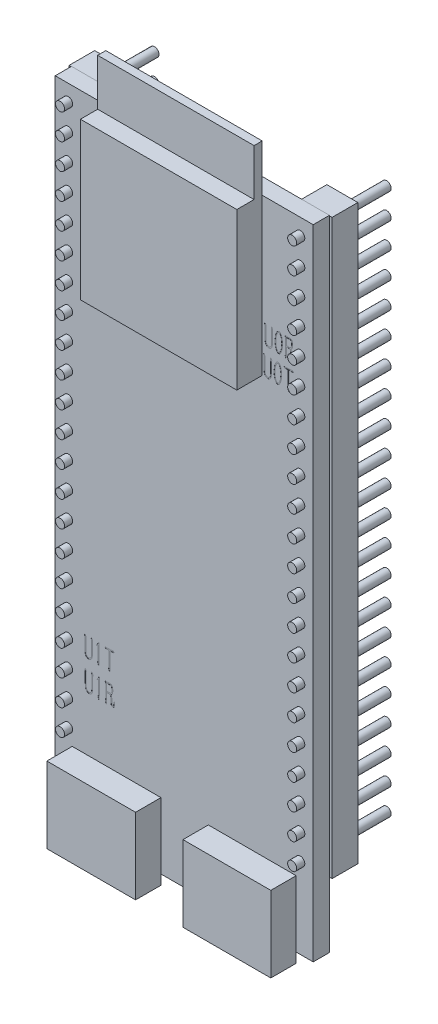
from build123d import *

# Parameters (mm, degrees)
SKETCH_2_W             = 25.4
SKETCH_2_H             = 62.865
EXTRUDE_1_DEPTH        = 1.6
SKETCH_3_W             = 8.735383535
SKETCH_3_H             = 7.474876022
SKETCH_3_W_2           = 8.65
EXTRUDE_2_DEPTH        = 2.5
SKETCH_4_W             = 15.4
SKETCH_4_H             = 15.4
EXTRUDE_3_DEPTH        = 2.5
SKETCH_6_W             = 15.4
SKETCH_6_H             = 4.6
EXTRUDE_4_DEPTH        = 0.8
EXTRUDE_START          = -8.5
SKETCH_7_R             = 0.4445
EXTRUDE_5_DEPTH        = 9.3
PATTERN_LINEAR_1_COUNT = 22
PATTERN_LINEAR_1_PITCH = 2.54
SKETCH_8_W             = 3.048
SKETCH_8_H             = 56.388
EXTRUDE_6_DEPTH        = 2.54
CUT_EXTRUDE_1_DEPTH    = 0.01
CUT_EXTRUDE_2_DEPTH    = 0.01


with BuildPart() as part:
    # 草图2 → 凸台-拉伸1 (new body)
    with BuildSketch(Plane.XY):
        with Locations((12.7, 31.4325)):
            Rectangle(SKETCH_2_W, SKETCH_2_H)
    extrude(amount=EXTRUDE_1_DEPTH)

    # 草图3 → 凸台-拉伸2 (add)
    with BuildSketch(Plane.XY.offset(1.6)):
        with Locations((6.042691768, 2.779561989)):
            Rectangle(SKETCH_3_W, SKETCH_3_H)
        with Locations((19.4, 2.779561989)):
            Rectangle(SKETCH_3_W_2, SKETCH_3_H)
    extrude(amount=EXTRUDE_2_DEPTH)

    # 草图4 → 凸台-拉伸3 (add)
    with BuildSketch(Plane.XY.offset(1.6)):
        with Locations((12.6784, 55.198)):
            Rectangle(SKETCH_4_W, SKETCH_4_H)
    extrude(amount=EXTRUDE_3_DEPTH)

    # 草图6 → 凸台-拉伸4 (add)
    with BuildSketch(Plane.XY.offset(1.6)):
        with Locations((12.6784, 65.198)):
            Rectangle(SKETCH_6_W, SKETCH_6_H)
    extrude(amount=EXTRUDE_4_DEPTH)

    # 草图7 → 凸台-拉伸5 (add)
    with BuildSketch(Plane.XY.offset(1.6).offset(EXTRUDE_START)):
        with Locations((1.27, 7.94995)):
            Circle(SKETCH_7_R)
        with Locations((24.13, 7.94995)):
            Circle(SKETCH_7_R)
    extrude_5 = extrude(amount=EXTRUDE_5_DEPTH)

    # 阵列(线性)1: 凸台-拉伸5 ×22
    with Locations(*[(0, i * PATTERN_LINEAR_1_PITCH, 0) for i in range(1, PATTERN_LINEAR_1_COUNT)]):
        add(extrude_5)

    # 草图8 → 凸台-拉伸6 (add)
    with BuildSketch(Plane(origin=(0, 0, 0), x_dir=(-1, 0, 0), z_dir=(0, 0, -1))):
        with Locations((-24.13, 34.61995)):
            Rectangle(SKETCH_8_W, SKETCH_8_H)
        with Locations((-1.27, 34.61995)):
            Rectangle(SKETCH_8_W, SKETCH_8_H)
    extrude(amount=EXTRUDE_6_DEPTH)

    # 草图9 → 切除-拉伸1 (cut)
    # profile 1 of 6: a face of its own
    with BuildSketch(Plane.XY.offset(1.6)):
        with BuildLine():
            add(Edge.make_bspline(
                [(3.038269821, 16.54986506), (3.035725863, 16.539919511), (3.031040795, 16.521603334), (3.022891924, 16.494933879), (3.017019835, 16.465902047), (3.011870802, 16.437767852), (3.008520302, 16.408803616), (3.0069218, 16.380160407), (3.006209476, 16.345848182), (3.005989448, 16.321035254), (3.005871682, 16.307754644)],
                knots=[0, 0, 0, 0, 1.003744274, 1.848541048, 2.724575739, 3.897541121, 4.644477337, 5.57374831, 6.701398654, 8, 8, 8, 8], degree=3))
            Line((3.005871682, 16.307754644), (3.005871682, 15.500865858))
            add(Edge.make_bspline(
                [(3.005871682, 15.500865858), (3.005992422, 15.469778691), (3.00622263, 15.410506059), (3.00922479, 15.325672004), (3.0145003, 15.249315981), (3.021067252, 15.181307072), (3.03049692, 15.121930651), (3.044662896, 15.071525562), (3.061275305, 15.029048964), (3.084153783, 14.995817166), (3.109427502, 14.969084167), (3.136383657, 14.94615677), (3.165127061, 14.92630835), (3.195899799, 14.910699372), (3.227071318, 14.898608409), (3.257695765, 14.889823927), (3.287323661, 14.884177424), (3.306771726, 14.883461975), (3.316280879, 14.883112155)],
                knots=[0, 0, 0, 0, 1.904871014, 3.631939653, 5.200580489, 6.594058469, 7.81871353, 8.877579113, 9.799367633, 10.598022971, 11.33197532, 12.048784225, 12.76313447, 13.467053215, 14.157899192, 14.808934827, 15.417627362, 16, 16, 16, 16], degree=3))
            add(Edge.make_bspline(
                [(3.316280879, 14.883112155), (3.330369874, 14.883201651), (3.357647794, 14.883374927), (3.396212318, 14.894148925), (3.431263098, 14.910624411), (3.460161766, 14.936008208), (3.484873682, 14.964519281), (3.506388002, 14.994622504), (3.523431165, 15.026160043), (3.540705565, 15.06957634), (3.555732467, 15.124981951), (3.567695151, 15.19084385), (3.574755585, 15.253481963), (3.576439874, 15.299312745), (3.576324534, 15.330848497), (3.576348065, 15.352009582), (3.57633939, 15.377986417), (3.576342369, 15.408925198), (3.576341366, 15.444825833), (3.576341694, 15.485688352), (3.576341593, 15.531512746), (3.576341608, 15.56361901), (3.576341616, 15.580547768)],
                knots=[0, 0, 0, 0, 1.015832844, 1.966769638, 2.874140611, 3.796887712, 4.72536528, 5.604927779, 6.470218719, 7.314013664, 8.983274287, 10.616524263, 12.1580784, 13.543398606, 13.934387562, 14.441616476, 15.07565262, 15.815361454, 16.681877516, 17.675200808, 18.774196789, 20, 20, 20, 20], degree=3))
            Line((3.576341616, 15.580547768), (3.576341616, 16.340152783))
            add(Edge.make_bspline(
                [(3.576341616, 16.340152783), (3.576168445, 16.362921335), (3.575849761, 16.404821984), (3.573696577, 16.463960702), (3.569858546, 16.517609088), (3.564185955, 16.559993047), (3.55938865, 16.591888373), (3.556696612, 16.612149958), (3.553072723, 16.628288676), (3.550673115, 16.637723994), (3.549635042, 16.641805725)],
                knots=[0, 0, 0, 0, 1.800427796, 3.313302028, 4.679007277, 6.05171569, 6.693108927, 7.230071941, 7.666928155, 8, 8, 8, 8], degree=3))
            Line((3.549635042, 16.641805725), (3.537814099, 16.689089495))
            Line((3.537814099, 16.689089495), (3.564520673, 16.718422946))
            Line((3.564520673, 16.718422946), (3.694551042, 16.541108807))
            add(Edge.make_bspline(
                [(3.694551042, 16.541108807), (3.690963708, 16.531216611), (3.684417346, 16.513164795), (3.67593266, 16.48581916), (3.670098828, 16.455115008), (3.664077087, 16.417819636), (3.659651153, 16.373230858), (3.659280178, 16.341622952), (3.659088214, 16.325267151)],
                knots=[0, 0, 0, 0, 0.860969545, 1.571143976, 2.339179594, 3.414861568, 4.662296442, 6, 6, 6, 6], degree=3))
            Line((3.659088214, 16.325267151), (3.652958836, 16.186480529))
            Line((3.652958836, 16.186480529), (3.652958836, 15.483353351))
            add(Edge.make_bspline(
                [(3.652958836, 15.483353351), (3.652957042, 15.465111144), (3.652953626, 15.430377982), (3.652976416, 15.381197169), (3.652904905, 15.33770732), (3.653196239, 15.286906793), (3.651082135, 15.225010116), (3.643205846, 15.150091353), (3.630305391, 15.074160683), (3.610938511, 15.012899309), (3.591228898, 14.965833851), (3.572917154, 14.93145695), (3.549990992, 14.898773348), (3.525498817, 14.86648033), (3.497325453, 14.838069196), (3.467272513, 14.813633848), (3.434735229, 14.795362363), (3.401044807, 14.782214717), (3.367352074, 14.774192522), (3.334993461, 14.769312414), (3.304096738, 14.767501506), (3.284307891, 14.769877266), (3.274688673, 14.771032106)],
                knots=[0, 0, 0, 0, 1.184396712, 2.255091339, 3.193133535, 4.007998473, 5.553497769, 7.210976229, 8.896625341, 10.544869866, 11.368501758, 12.207897336, 13.067269996, 13.9581379, 14.835858175, 15.658617576, 16.464842951, 17.247850116, 17.999321596, 18.708188718, 19.372059715, 20, 20, 20, 20], degree=3))
            add(Edge.make_bspline(
                [(3.274688673, 14.771032106), (3.259852078, 14.77322131), (3.229786553, 14.777657608), (3.185449583, 14.792750257), (3.141407459, 14.814516072), (3.098380617, 14.842563304), (3.057992068, 14.876103507), (3.024100341, 14.916176581), (2.996045992, 14.96072874), (2.97534853, 15.010554338), (2.959464294, 15.064129833), (2.946964631, 15.121101467), (2.937122183, 15.181295518), (2.929620169, 15.266207203), (2.924502114, 15.375146649), (2.923585448, 15.462916048), (2.923125084, 15.506995236)],
                knots=[0, 0, 0, 0, 0.695534074, 1.409460652, 2.164441113, 2.973040665, 3.790768921, 4.593778482, 5.400813321, 6.226929901, 7.091249032, 7.994267031, 8.934978771, 9.922599692, 11.952264706, 14, 14, 14, 14], degree=3))
            Line((2.923125084, 15.506995236), (2.923125084, 16.34628216))
            add(Edge.make_bspline(
                [(2.923125084, 16.34628216), (2.923079765, 16.368763757), (2.922994358, 16.411131874), (2.919118598, 16.471561808), (2.914215834, 16.526277769), (2.909629078, 16.56875709), (2.90523405, 16.599470535), (2.90299446, 16.618697008), (2.899828747, 16.634297395), (2.897472127, 16.643419087), (2.89641851, 16.64749729)],
                knots=[0, 0, 0, 0, 1.780757902, 3.355960879, 4.795327259, 6.133470747, 6.740138127, 7.253591479, 7.666289372, 8, 8, 8, 8], degree=3))
            Line((2.89641851, 16.64749729), (2.884597568, 16.69478106))
            Line((2.884597568, 16.69478106), (2.908239453, 16.724552323))
            Line((2.908239453, 16.724552323), (3.038269821, 16.54986506))
        make_face()
    # profile 2 of 6: a face of its own
    with BuildSketch(Plane.XY.offset(1.6)):
        with BuildLine():
            Line((4.276404105, 16.677268553), (4.308802244, 16.677268553))
            Line((4.308802244, 16.677268553), (4.305737555, 15.107710064))
            add(Edge.make_bspline(
                [(4.305737555, 15.107710064), (4.305388429, 15.093555083), (4.30471902, 15.066414482), (4.304664692, 15.027583321), (4.303387629, 14.992425306), (4.303285911, 14.960890102), (4.302336307, 14.933018905), (4.301238182, 14.908805882), (4.301133839, 14.888205648), (4.299191453, 14.855963624), (4.296876841, 14.811633244), (4.291136725, 14.765973706), (4.286567161, 14.733439375), (4.281921822, 14.718629179), (4.276036655, 14.706910866), (4.27016327, 14.708277438), (4.267647851, 14.708862705)],
                knots=[0, 0, 0, 0, 1.45038606, 2.780953852, 3.977268029, 5.053718292, 6.010937745, 6.833690271, 7.536464333, 8.120251454, 10.142880859, 12.069479857, 12.873132744, 13.440417135, 13.76034519, 14, 14, 14, 14], degree=3))
            add(Edge.make_bspline(
                [(4.267647851, 14.708862705), (4.267066367, 14.709302849), (4.264577471, 14.711186772), (4.258642144, 14.715174345), (4.251589751, 14.72586327), (4.248502655, 14.735452672), (4.246632842, 14.741260844)],
                knots=[0, 0, 0, 0, 0.221265066, 0.947068446, 2.150880552, 4, 4, 4, 4], degree=3))
            Line((4.246632842, 14.741260844), (4.232185023, 14.77978836))
            Line((4.232185023, 14.77978836), (4.199349072, 14.886176844))
            add(Edge.make_bspline(
                [(4.199349072, 14.886176844), (4.195396331, 14.896186904), (4.188510862, 14.913623912), (4.181564943, 14.936564718), (4.176295534, 14.951213391), (4.174894968, 14.963086778), (4.181641502, 14.974224047), (4.186610093, 14.991372044), (4.194255427, 15.013260335), (4.201475242, 15.039094449), (4.20785204, 15.067007802), (4.213596424, 15.097167301), (4.216851931, 15.131147028), (4.218448884, 15.163590534), (4.21967445, 15.194826827), (4.219897117, 15.224898677), (4.220511261, 15.260504667), (4.22041532, 15.286191308), (4.220364081, 15.299909834)],
                knots=[0, 0, 0, 0, 1.220359697, 2.125803599, 2.712350858, 2.994193817, 3.439826662, 4.12562012, 5.031064022, 6.063176816, 7.167225426, 8.277459231, 9.542238136, 11.034069985, 11.961482632, 13.08703073, 14.444263491, 16, 16, 16, 16], degree=3))
            Line((4.220364081, 15.299909834), (4.222990957, 16.458362209))
            Line((4.222990957, 16.458362209), (4.069318703, 16.325267151))
            Line((4.069318703, 16.325267151), (4.057497761, 16.37561561))
            add(Edge.make_bspline(
                [(4.057497761, 16.37561561), (4.069989146, 16.388523023), (4.093404764, 16.412718499), (4.124698408, 16.447555637), (4.150436336, 16.477788755), (4.177244105, 16.513132686), (4.207258461, 16.557117988), (4.229423115, 16.593255248), (4.240941277, 16.612034462)],
                knots=[0, 0, 0, 0, 1.077185482, 2.019228619, 2.808185376, 3.45765616, 4.678836699, 6, 6, 6, 6], degree=3))
            Line((4.240941277, 16.612034462), (4.276404105, 16.677268553))
        make_face()
    # profile 3 of 6: a face of its own
    with BuildSketch(Plane.XY.offset(1.6)):
        with BuildLine():
            Line((5.388448334, 16.526223175), (5.388448334, 15.102018499))
            Line((5.388448334, 15.102018499), (5.373562703, 14.809559623))
            add(Edge.make_bspline(
                [(5.373562703, 14.809559623), (5.373387529, 14.79533397), (5.373073229, 14.769810164), (5.368124352, 14.740942048), (5.363316819, 14.722933312), (5.35993924, 14.716020989), (5.356728911, 14.710124868), (5.354067364, 14.711406457), (5.352985506, 14.711927393)],
                knots=[0, 0, 0, 0, 2.43675652, 4.372052466, 5.078871199, 5.550454925, 5.817270194, 6, 6, 6, 6], degree=3))
            add(Edge.make_bspline(
                [(5.352985506, 14.711927393), (5.351660506, 14.712325482), (5.348395185, 14.713306528), (5.341968676, 14.716893173), (5.335414721, 14.728178964), (5.32907957, 14.744988742), (5.321985393, 14.764047867), (5.318879868, 14.777134066), (5.317522679, 14.782853049)],
                knots=[0, 0, 0, 0, 0.30288637, 0.746430801, 1.570370807, 3.058663464, 4.714565407, 6, 6, 6, 6], degree=3))
            Line((5.317522679, 14.782853049), (5.282059851, 14.889241532))
            add(Edge.make_bspline(
                [(5.282059851, 14.889241532), (5.27866844, 14.89856605), (5.272706514, 14.914958076), (5.265374271, 14.936459421), (5.261503038, 14.95178828), (5.260302125, 14.965298786), (5.266249881, 14.979472112), (5.273304565, 14.997954794), (5.281156926, 15.019522643), (5.286946755, 15.043433159), (5.290642471, 15.069568942), (5.29429524, 15.100075811), (5.297797894, 15.138335517), (5.301673496, 15.186184425), (5.30558496, 15.243374977), (5.305661471, 15.284432276), (5.305701736, 15.306039212)],
                knots=[0, 0, 0, 0, 0.980641267, 1.723917205, 2.241620292, 2.544775778, 3.041991924, 3.722164793, 4.515637936, 5.302532678, 6.148880555, 7.121858782, 8.338588997, 9.944421189, 11.865699026, 14, 14, 14, 14], degree=3))
            Line((5.305701736, 15.306039212), (5.305701736, 16.523596299))
            add(Edge.make_bspline(
                [(5.305701736, 16.523596299), (5.297378896, 16.523559799), (5.282034753, 16.523492507), (5.262213556, 16.521959592), (5.243229568, 16.520836697), (5.22119632, 16.519009934), (5.190695818, 16.51638288), (5.155117374, 16.512965434), (5.120186477, 16.510494927), (5.092363816, 16.507574454), (5.074398769, 16.506247453), (5.065780689, 16.505786499), (5.063153506, 16.505645979)],
                knots=[0, 0, 0, 0, 1.025992475, 1.891538789, 2.450608741, 3.371279513, 4.617765367, 6.225964987, 7.778834079, 8.935698997, 9.675552692, 10, 10, 10, 10], degree=3))
            Line((5.063153506, 16.505645979), (5.004048793, 16.496889725))
            Line((5.004048793, 16.496889725), (4.903789688, 16.582701012))
            add(Edge.make_bspline(
                [(4.903789688, 16.582701012), (4.899034625, 16.587307271), (4.891687644, 16.594424336), (4.884770132, 16.60616775), (4.886878344, 16.614097987), (4.890058187, 16.62063178), (4.898913712, 16.623834033), (4.905558576, 16.623847472), (4.909481253, 16.623855405)],
                knots=[0, 0, 0, 0, 1.88901374, 2.918688365, 3.546721585, 4.117087209, 4.888455958, 6, 6, 6, 6], degree=3))
            add(Edge.make_bspline(
                [(4.909481253, 16.623855405), (4.911371097, 16.623368059), (4.917661217, 16.621745988), (4.931558574, 16.621797295), (4.953230625, 16.620366407), (4.970473628, 16.620635626), (4.980406908, 16.620790716)],
                knots=[0, 0, 0, 0, 0.328519165, 1.093436259, 2.325598431, 4, 4, 4, 4], degree=3))
            Line((4.980406908, 16.620790716), (5.027690679, 16.61816384))
            add(Edge.make_bspline(
                [(5.027690679, 16.61816384), (5.029432844, 16.617651415), (5.034977844, 16.616020457), (5.047304757, 16.617368526), (5.06621113, 16.616390368), (5.081244172, 16.617517719), (5.08986008, 16.61816384)],
                knots=[0, 0, 0, 0, 0.347341643, 1.105526146, 2.341086076, 4, 4, 4, 4], degree=3))
            Line((5.08986008, 16.61816384), (5.152029482, 16.61816384))
            Line((5.152029482, 16.61816384), (5.305701736, 16.623855405))
            Line((5.305701736, 16.623855405), (5.429602727, 16.626920094))
            add(Edge.make_bspline(
                [(5.429602727, 16.626920094), (5.440274125, 16.627312936), (5.465086019, 16.628226326), (5.50519252, 16.634784423), (5.55007823, 16.641039024), (5.587887112, 16.645546791), (5.615341757, 16.647841949), (5.63073506, 16.650696244), (5.641527565, 16.652738463), (5.64663626, 16.655310612), (5.648509071, 16.656253544)],
                knots=[0, 0, 0, 0, 1.156915626, 2.689925566, 4.399695503, 6.072075551, 6.820020126, 7.381954211, 7.77342877, 8, 8, 8, 8], degree=3))
            Line((5.648509071, 16.656253544), (5.710678473, 16.679895429))
            Line((5.710678473, 16.679895429), (5.796051947, 16.573506946))
            add(Edge.make_bspline(
                [(5.796051947, 16.573506946), (5.799999125, 16.567961706), (5.806246372, 16.559185185), (5.812310043, 16.547440495), (5.813085521, 16.539964741), (5.811711846, 16.534598194), (5.806238983, 16.533262507), (5.799307301, 16.533398368), (5.788614652, 16.531916839), (5.780288265, 16.532192939), (5.775474751, 16.532352553)],
                knots=[0, 0, 0, 0, 2.075716626, 3.285262792, 3.906827215, 4.383787294, 4.762155351, 5.472092002, 6.53860716, 8, 8, 8, 8], degree=3))
            Line((5.775474751, 16.532352553), (5.713305349, 16.532352553))
            Line((5.713305349, 16.532352553), (5.491772129, 16.529287864))
            add(Edge.make_bspline(
                [(5.491772129, 16.529287864), (5.480681431, 16.529788018), (5.46069472, 16.530689353), (5.434283254, 16.531077691), (5.414811666, 16.531081368), (5.404350905, 16.529791249), (5.400269277, 16.529287864)],
                knots=[0, 0, 0, 0, 1.454015493, 2.620302767, 3.461663352, 4, 4, 4, 4], degree=3))
            Line((5.400269277, 16.529287864), (5.388448334, 16.526223175))
        make_face()
    # profile 4 of 6: a face of its own
    with BuildSketch(Plane.XY.offset(1.6)):
        with BuildLine():
            add(Edge.make_bspline(
                [(3.06903324, 13.632836609), (3.066489282, 13.62289106), (3.061804213, 13.604574883), (3.053655342, 13.577905428), (3.047783253, 13.548873596), (3.04263422, 13.520739401), (3.03928372, 13.491775165), (3.037685218, 13.463131956), (3.036972894, 13.428819731), (3.036752866, 13.404006803), (3.036635101, 13.390726193)],
                knots=[0, 0, 0, 0, 1.003744274, 1.848541048, 2.724575739, 3.897541121, 4.644477337, 5.57374831, 6.701398654, 8, 8, 8, 8], degree=3))
            Line((3.036635101, 13.390726193), (3.036635101, 12.583837407))
            add(Edge.make_bspline(
                [(3.036635101, 12.583837407), (3.03675584, 12.55275024), (3.036986049, 12.493477608), (3.039988208, 12.408643553), (3.045263718, 12.33228753), (3.051830671, 12.264278621), (3.061260338, 12.2049022), (3.075426314, 12.154497111), (3.092038724, 12.112020513), (3.114917202, 12.078788715), (3.14019092, 12.052055716), (3.167147075, 12.029128319), (3.19589048, 12.009279899), (3.226663218, 11.993670921), (3.257834737, 11.981579958), (3.288459183, 11.972795476), (3.318087079, 11.967148973), (3.337535144, 11.966433524), (3.347044297, 11.966083704)],
                knots=[0, 0, 0, 0, 1.904871014, 3.631939653, 5.200580489, 6.594058469, 7.81871353, 8.877579113, 9.799367633, 10.598022971, 11.33197532, 12.048784225, 12.76313447, 13.467053215, 14.157899192, 14.808934827, 15.417627362, 16, 16, 16, 16], degree=3))
            add(Edge.make_bspline(
                [(3.347044297, 11.966083704), (3.361133292, 11.9661732), (3.388411213, 11.966346476), (3.426975737, 11.977120474), (3.462026516, 11.99359596), (3.490925184, 12.018979757), (3.515637101, 12.04749083), (3.537151421, 12.077594053), (3.554194584, 12.109131592), (3.571468984, 12.152547889), (3.586495886, 12.2079535), (3.598458569, 12.273815399), (3.605519004, 12.336453512), (3.607203292, 12.382284294), (3.607087953, 12.413820046), (3.607111483, 12.434981131), (3.607102808, 12.460957966), (3.607105787, 12.491896747), (3.607104785, 12.527797382), (3.607105112, 12.568659901), (3.607105011, 12.614484296), (3.607105026, 12.646590559), (3.607105034, 12.663519317)],
                knots=[0, 0, 0, 0, 1.015832844, 1.966769638, 2.874140611, 3.796887712, 4.72536528, 5.604927779, 6.470218719, 7.314013664, 8.983274287, 10.616524263, 12.1580784, 13.543398606, 13.934387562, 14.441616476, 15.07565262, 15.815361454, 16.681877516, 17.675200808, 18.774196789, 20, 20, 20, 20], degree=3))
            Line((3.607105034, 12.663519317), (3.607105034, 13.423124332))
            add(Edge.make_bspline(
                [(3.607105034, 13.423124332), (3.606931863, 13.445892884), (3.606613179, 13.487793533), (3.604459996, 13.546932251), (3.600621964, 13.600580637), (3.594949373, 13.642964596), (3.590152068, 13.674859922), (3.58746003, 13.695121507), (3.583836141, 13.711260225), (3.581436533, 13.720695543), (3.58039846, 13.724777274)],
                knots=[0, 0, 0, 0, 1.800427796, 3.313302028, 4.679007277, 6.05171569, 6.693108927, 7.230071941, 7.666928155, 8, 8, 8, 8], degree=3))
            Line((3.58039846, 13.724777274), (3.568577517, 13.772061044))
            Line((3.568577517, 13.772061044), (3.595284091, 13.801394495))
            Line((3.595284091, 13.801394495), (3.72531446, 13.624080356))
            add(Edge.make_bspline(
                [(3.72531446, 13.624080356), (3.721727126, 13.61418816), (3.715180764, 13.596136344), (3.706696079, 13.568790709), (3.700862246, 13.538086557), (3.694840506, 13.500791185), (3.690414572, 13.456202407), (3.690043597, 13.424594501), (3.689851632, 13.4082387)],
                knots=[0, 0, 0, 0, 0.860969545, 1.571143976, 2.339179594, 3.414861568, 4.662296442, 6, 6, 6, 6], degree=3))
            Line((3.689851632, 13.4082387), (3.683722255, 13.269452078))
            Line((3.683722255, 13.269452078), (3.683722255, 12.5663249))
            add(Edge.make_bspline(
                [(3.683722255, 12.5663249), (3.683720461, 12.548082693), (3.683717045, 12.513349531), (3.683739835, 12.464168718), (3.683668323, 12.420678869), (3.683959658, 12.369878342), (3.681845553, 12.307981665), (3.673969265, 12.233062902), (3.661068809, 12.157132232), (3.641701929, 12.095870858), (3.621992316, 12.0488054), (3.603680572, 12.014428499), (3.580754411, 11.981744897), (3.556262235, 11.949451879), (3.528088871, 11.921040745), (3.498035932, 11.896605397), (3.465498648, 11.878333912), (3.431808225, 11.865186266), (3.398115492, 11.857164071), (3.365756879, 11.852283963), (3.334860156, 11.850473055), (3.315071309, 11.852848815), (3.305452092, 11.854003655)],
                knots=[0, 0, 0, 0, 1.184396712, 2.255091339, 3.193133535, 4.007998473, 5.553497769, 7.210976229, 8.896625341, 10.544869866, 11.368501758, 12.207897336, 13.067269996, 13.9581379, 14.835858175, 15.658617576, 16.464842951, 17.247850116, 17.999321596, 18.708188718, 19.372059715, 20, 20, 20, 20], degree=3))
            add(Edge.make_bspline(
                [(3.305452092, 11.854003655), (3.290615496, 11.856192859), (3.260549971, 11.860629157), (3.216213001, 11.875721806), (3.172170878, 11.897487621), (3.129144036, 11.925534853), (3.088755486, 11.959075056), (3.054863759, 11.99914813), (3.02680941, 12.043700289), (3.006111949, 12.093525887), (2.990227712, 12.147101382), (2.977728049, 12.204073016), (2.967885601, 12.264267067), (2.960383587, 12.349178752), (2.955265533, 12.458118198), (2.954348867, 12.545887597), (2.953888503, 12.589966785)],
                knots=[0, 0, 0, 0, 0.695534074, 1.409460652, 2.164441113, 2.973040665, 3.790768921, 4.593778482, 5.400813321, 6.226929901, 7.091249032, 7.994267031, 8.934978771, 9.922599692, 11.952264706, 14, 14, 14, 14], degree=3))
            Line((2.953888503, 12.589966785), (2.953888503, 13.429253709))
            add(Edge.make_bspline(
                [(2.953888503, 13.429253709), (2.953843183, 13.451735306), (2.953757776, 13.494103423), (2.949882016, 13.554533357), (2.944979252, 13.609249318), (2.940392496, 13.651728639), (2.935997468, 13.682442084), (2.933757879, 13.701668557), (2.930592165, 13.717268944), (2.928235546, 13.726390636), (2.927181929, 13.730468839)],
                knots=[0, 0, 0, 0, 1.780757902, 3.355960879, 4.795327259, 6.133470747, 6.740138127, 7.253591479, 7.666289372, 8, 8, 8, 8], degree=3))
            Line((2.927181929, 13.730468839), (2.915360986, 13.777752609))
            Line((2.915360986, 13.777752609), (2.939002871, 13.807523872))
            Line((2.939002871, 13.807523872), (3.06903324, 13.632836609))
        make_face()
    # profile 5 of 6: a face of its own
    with BuildSketch(Plane.XY.offset(1.6)):
        with BuildLine():
            Line((4.307167523, 13.760240102), (4.339565662, 13.760240102))
            Line((4.339565662, 13.760240102), (4.336500973, 12.190681613))
            add(Edge.make_bspline(
                [(4.336500973, 12.190681613), (4.336151848, 12.176526632), (4.335482439, 12.149386031), (4.33542811, 12.11055487), (4.334151047, 12.075396855), (4.334049329, 12.043861651), (4.333099726, 12.015990454), (4.332001601, 11.991777431), (4.331897258, 11.971177197), (4.329954871, 11.938935173), (4.32764026, 11.894604793), (4.321900144, 11.848945255), (4.317330579, 11.816410924), (4.312685241, 11.801600728), (4.306800073, 11.789882415), (4.300926688, 11.791248987), (4.298411269, 11.791834254)],
                knots=[0, 0, 0, 0, 1.45038606, 2.780953852, 3.977268029, 5.053718292, 6.010937745, 6.833690271, 7.536464333, 8.120251454, 10.142880859, 12.069479857, 12.873132744, 13.440417135, 13.76034519, 14, 14, 14, 14], degree=3))
            add(Edge.make_bspline(
                [(4.298411269, 11.791834254), (4.297829785, 11.792274398), (4.295340889, 11.794158321), (4.289405562, 11.798145894), (4.28235317, 11.808834819), (4.279266073, 11.818424221), (4.27739626, 11.824232393)],
                knots=[0, 0, 0, 0, 0.221265066, 0.947068446, 2.150880552, 4, 4, 4, 4], degree=3))
            Line((4.27739626, 11.824232393), (4.262948442, 11.862759909))
            Line((4.262948442, 11.862759909), (4.23011249, 11.969148393))
            add(Edge.make_bspline(
                [(4.23011249, 11.969148393), (4.22615975, 11.979158453), (4.21927428, 11.996595461), (4.212328361, 12.019536267), (4.207058952, 12.03418494), (4.205658386, 12.046058327), (4.21240492, 12.057195596), (4.217373512, 12.074343593), (4.225018846, 12.096231884), (4.23223866, 12.122065998), (4.238615459, 12.149979351), (4.244359842, 12.18013885), (4.247615349, 12.214118577), (4.249212302, 12.246562083), (4.250437869, 12.277798377), (4.250660535, 12.307870226), (4.251274679, 12.343476216), (4.251178739, 12.369162857), (4.251127499, 12.382881383)],
                knots=[0, 0, 0, 0, 1.220359697, 2.125803599, 2.712350858, 2.994193817, 3.439826662, 4.12562012, 5.031064022, 6.063176816, 7.167225426, 8.277459231, 9.542238136, 11.034069985, 11.961482632, 13.08703073, 14.444263491, 16, 16, 16, 16], degree=3))
            Line((4.251127499, 12.382881383), (4.253754375, 13.541333758))
            Line((4.253754375, 13.541333758), (4.100082121, 13.4082387))
            Line((4.100082121, 13.4082387), (4.088261179, 13.458587159))
            add(Edge.make_bspline(
                [(4.088261179, 13.458587159), (4.100752564, 13.471494572), (4.124168182, 13.495690048), (4.155461826, 13.530527186), (4.181199754, 13.560760304), (4.208007523, 13.596104235), (4.238021879, 13.640089537), (4.260186533, 13.676226797), (4.271704695, 13.695006011)],
                knots=[0, 0, 0, 0, 1.077185482, 2.019228619, 2.808185376, 3.45765616, 4.678836699, 6, 6, 6, 6], degree=3))
            Line((4.271704695, 13.695006011), (4.307167523, 13.760240102))
        make_face()
    # profile 6 of 6: a face of its own
    with BuildSketch(Plane.XY.offset(1.6)):
        with BuildLine():
            add(Edge.make_bspline(
                [(5.478316465, 12.823320948), (5.487083487, 12.810633337), (5.50298323, 12.787623268), (5.525667943, 12.754446221), (5.543622124, 12.719020188), (5.554936056, 12.675673385), (5.563822694, 12.623347144), (5.570340616, 12.562498305), (5.57550248, 12.495193142), (5.575797611, 12.448418544), (5.575948695, 12.424473589)],
                knots=[0, 0, 0, 0, 0.881232765, 1.598190978, 2.295533752, 3.137383339, 4.144986829, 5.328248715, 6.632271209, 8, 8, 8, 8], degree=3))
            Line((5.575948695, 12.424473589), (5.584704949, 12.14952722))
            add(Edge.make_bspline(
                [(5.584704949, 12.14952722), (5.584991332, 12.134217829), (5.585545179, 12.104610369), (5.586408367, 12.062865421), (5.591060928, 12.028467888), (5.596756437, 12.003459859), (5.609597532, 11.990547941), (5.624309779, 11.984649344), (5.644120258, 11.98168796), (5.659121157, 11.981225919), (5.667451547, 11.980969335)],
                knots=[0, 0, 0, 0, 1.650852431, 3.192651296, 4.477622576, 5.427192863, 5.849578153, 6.384274066, 7.102745334, 8, 8, 8, 8], degree=3))
            add(Edge.make_bspline(
                [(5.667451547, 11.980969335), (5.67581164, 11.980569998), (5.691452513, 11.97982288), (5.714232374, 11.987282592), (5.732798674, 12.004063923), (5.745635358, 12.029813212), (5.75532245, 12.061685464), (5.760735516, 12.100262362), (5.766059498, 12.145669488), (5.769105663, 12.178703973), (5.770775341, 12.196810991)],
                knots=[0, 0, 0, 0, 0.741895998, 1.388010978, 2.079699508, 2.912679041, 3.92113713, 5.042206699, 6.378760387, 8, 8, 8, 8], degree=3))
            Line((5.770775341, 12.196810991), (5.785660973, 12.365368876))
            Line((5.785660973, 12.365368876), (5.824188489, 12.365368876))
            Line((5.824188489, 12.365368876), (5.824188489, 12.158283474))
            add(Edge.make_bspline(
                [(5.824188489, 12.158283474), (5.824019624, 12.138724524), (5.823708233, 12.102657533), (5.821563037, 12.053304568), (5.818490483, 12.013189154), (5.813294935, 11.981520131), (5.806184619, 11.955760247), (5.79608301, 11.934444617), (5.783762211, 11.915720548), (5.768229243, 11.901146736), (5.751516417, 11.889010733), (5.73320831, 11.880282017), (5.713945408, 11.873957567), (5.68799998, 11.870502376), (5.658531982, 11.869689954), (5.635924981, 11.870953553), (5.625859341, 11.871516163)],
                knots=[0, 0, 0, 0, 1.955595562, 3.606146949, 4.93917426, 5.975540879, 6.81139212, 7.601269519, 8.32576276, 9.0378047, 9.718034635, 10.383709129, 11.057491241, 11.736467872, 12.992175141, 14, 14, 14, 14], degree=3))
            add(Edge.make_bspline(
                [(5.625859341, 11.871516163), (5.618801422, 11.872110574), (5.60532868, 11.873245235), (5.586688748, 11.879329399), (5.570106179, 11.887106963), (5.555676841, 11.897853794), (5.54357467, 11.911952487), (5.533591052, 11.929446415), (5.52490163, 11.950203247), (5.517354635, 11.974959469), (5.511095277, 12.005105138), (5.507313584, 12.041915846), (5.503598478, 12.085837506), (5.502532494, 12.117557211), (5.501958351, 12.134641589)],
                knots=[0, 0, 0, 0, 0.785514098, 1.499454538, 2.167605402, 2.81714562, 3.484704239, 4.219933844, 5.049370252, 5.984178009, 7.095655963, 8.469322192, 10.098360771, 12, 12, 12, 12], degree=3))
            Line((5.501958351, 12.134641589), (5.498893662, 12.2764929))
            Line((5.498893662, 12.2764929), (5.495828973, 12.4214089))
            add(Edge.make_bspline(
                [(5.495828973, 12.4214089), (5.494745448, 12.440387111), (5.492443243, 12.480710805), (5.487227653, 12.541726382), (5.481565754, 12.600865057), (5.471240105, 12.652842351), (5.455970343, 12.696749709), (5.435807987, 12.734149439), (5.410934891, 12.765101661), (5.379769299, 12.786528069), (5.343350862, 12.79849091), (5.301848736, 12.805029241), (5.254458495, 12.80747109), (5.221025361, 12.806096511), (5.203370097, 12.805370628)],
                knots=[0, 0, 0, 0, 1.186982176, 2.522024164, 3.82431485, 4.894934829, 5.823070192, 6.716229133, 7.537699214, 8.278355097, 9.042196562, 9.911176558, 10.896940655, 12, 12, 12, 12], degree=3))
            Line((5.203370097, 12.805370628), (5.058454097, 12.793549685))
            Line((5.058454097, 12.793549685), (5.058454097, 12.096114072))
            add(Edge.make_bspline(
                [(5.058454097, 12.096114072), (5.057170944, 12.073199721), (5.054833187, 12.031452404), (5.05128018, 11.97528199), (5.04855383, 11.9316428), (5.046471144, 11.891794997), (5.043733822, 11.853630476), (5.039670979, 11.821537588), (5.035195534, 11.800665794), (5.033033826, 11.791904955), (5.030133982, 11.784897635), (5.027150357, 11.78580856), (5.026055958, 11.786142689)],
                knots=[0, 0, 0, 0, 2.178702561, 3.969346042, 5.343442504, 6.32866056, 7.759955515, 8.962971945, 9.43033784, 9.732921223, 9.902035012, 10, 10, 10, 10], degree=3))
            add(Edge.make_bspline(
                [(5.026055958, 11.786142689), (5.024729783, 11.786539691), (5.021461569, 11.78751806), (5.014996869, 11.791184448), (5.007977804, 11.802417693), (5.000229767, 11.818908326), (4.992810591, 11.838057795), (4.991262166, 11.851332623), (4.99059313, 11.857068344)],
                knots=[0, 0, 0, 0, 0.301236197, 0.742364128, 1.580669581, 3.100179862, 4.747060191, 6, 6, 6, 6], degree=3))
            Line((4.99059313, 11.857068344), (4.955130302, 11.963456828))
            add(Edge.make_bspline(
                [(4.955130302, 11.963456828), (4.95179424, 11.973089858), (4.945937449, 11.990001607), (4.938158003, 12.011747133), (4.934031339, 12.026581989), (4.931950036, 12.038535525), (4.937004788, 12.050618548), (4.944274595, 12.066787705), (4.952585812, 12.088924539), (4.95971884, 12.115505447), (4.965950084, 12.142509924), (4.970013583, 12.165328789), (4.971510364, 12.186595062), (4.973486135, 12.210496207), (4.974476507, 12.242927272), (4.975643883, 12.280580267), (4.977070895, 12.317203569), (4.977498711, 12.34655594), (4.978870072, 12.365359714), (4.978795135, 12.374416447), (4.978772188, 12.377189818)],
                knots=[0, 0, 0, 0, 1.301962309, 2.285725083, 2.940890519, 3.278257869, 3.802826989, 4.553745501, 5.567560366, 6.806006901, 8.066807115, 9.104973239, 9.759343731, 10.786589445, 12.166193442, 13.899498157, 15.595566675, 16.84419832, 17.646068083, 18, 18, 18, 18], degree=3))
            Line((4.978772188, 12.377189818), (4.978772188, 13.532577504))
            add(Edge.make_bspline(
                [(4.978772188, 13.532577504), (4.978570506, 13.541504496), (4.978184785, 13.558577621), (4.973884632, 13.582847077), (4.968470769, 13.605047386), (4.961525842, 13.617910898), (4.958194991, 13.624080356)],
                knots=[0, 0, 0, 0, 1.127954724, 2.157245254, 3.116197974, 4, 4, 4, 4], degree=3))
            Line((4.958194991, 13.624080356), (4.928423728, 13.668299437))
            add(Edge.make_bspline(
                [(4.928423728, 13.668299437), (4.92543203, 13.673642887), (4.920049257, 13.683257017), (4.913800137, 13.696840374), (4.911768636, 13.70776234), (4.911054091, 13.717015974), (4.917774673, 13.72372206), (4.929119509, 13.725168571), (4.944851531, 13.725156998), (4.956892331, 13.722978199), (4.963886556, 13.721712585)],
                knots=[0, 0, 0, 0, 1.380566717, 2.483966017, 3.320820912, 3.912566683, 4.446905125, 5.258929739, 6.407774973, 8, 8, 8, 8], degree=3))
            Line((4.963886556, 13.721712585), (5.026055958, 13.715583208))
            Line((5.026055958, 13.715583208), (5.08822536, 13.706826954))
            Line((5.08822536, 13.706826954), (5.203370097, 13.715583208))
            add(Edge.make_bspline(
                [(5.203370097, 13.715583208), (5.226132395, 13.717114925), (5.267851845, 13.719922305), (5.324940214, 13.722763548), (5.370619496, 13.72538999), (5.406762318, 13.727618827), (5.437222582, 13.727864891), (5.465499445, 13.72267959), (5.493216051, 13.713972514), (5.519921897, 13.701122738), (5.54506994, 13.685110848), (5.56801538, 13.666145651), (5.588463402, 13.644480427), (5.606187318, 13.61940876), (5.621916112, 13.590473268), (5.634224439, 13.556111212), (5.64530172, 13.516823296), (5.653082422, 13.472176845), (5.659629642, 13.423249093), (5.664450875, 13.370377763), (5.666960749, 13.313696421), (5.667284364, 13.274708177), (5.667451547, 13.254566446)],
                knots=[0, 0, 0, 0, 1.680330416, 3.079761997, 4.210278293, 5.049824392, 5.748610684, 6.446652486, 7.157163236, 7.883197757, 8.622714282, 9.348032282, 10.070477093, 10.810227951, 11.603784503, 12.488235885, 13.492302087, 14.607589106, 15.822258459, 17.128285687, 18.516442711, 20, 20, 20, 20], degree=3))
            add(Edge.make_bspline(
                [(5.667451547, 13.254566446), (5.667291138, 13.235300477), (5.666990806, 13.19922886), (5.664650003, 13.149087913), (5.659978215, 13.106664475), (5.651485108, 13.06167194), (5.637099908, 13.013347911), (5.616889286, 12.961825413), (5.594455763, 12.917067022), (5.573642407, 12.88552178), (5.556559009, 12.86552608), (5.545338065, 12.853654943), (5.533920232, 12.845602541), (5.526095711, 12.842324821), (5.522535547, 12.840833456)],
                knots=[0, 0, 0, 0, 1.521433389, 2.848575118, 3.962184411, 4.888901171, 6.460870269, 7.93539991, 9.254863418, 10.408771879, 10.907539274, 11.331296887, 11.695739513, 12, 12, 12, 12], degree=3))
            Line((5.522535547, 12.840833456), (5.478316465, 12.823320948))
        make_face()
        with BuildLine():
            Line((5.055827221, 12.903002857), (5.348286097, 12.9148238))
            add(Edge.make_bspline(
                [(5.348286097, 12.9148238), (5.359979692, 12.915505999), (5.382145755, 12.916799156), (5.413360277, 12.921599804), (5.44074719, 12.928388787), (5.471125506, 12.940446018), (5.502881947, 12.959898276), (5.528172316, 12.985599805), (5.543586187, 13.009772227), (5.552790814, 13.031561786), (5.561886228, 13.056101619), (5.568666633, 13.085096786), (5.575142567, 13.119500745), (5.579008601, 13.16139638), (5.582165573, 13.211176234), (5.583091197, 13.266816351), (5.583258546, 13.323365903), (5.579615389, 13.376118957), (5.574022263, 13.422754165), (5.567283237, 13.451334204), (5.564127752, 13.464716537)],
                knots=[0, 0, 0, 0, 0.918061632, 1.740252825, 2.473002692, 3.125389995, 4.297175273, 5.365424526, 5.921000699, 6.535663214, 7.216150394, 7.97108314, 8.866688876, 9.959840128, 11.266871048, 12.777820325, 14.322752802, 15.699036693, 16.922595727, 18, 18, 18, 18], degree=3))
            add(Edge.make_bspline(
                [(5.564127752, 13.464716537), (5.560692607, 13.477107497), (5.554250648, 13.500344382), (5.539835474, 13.53111626), (5.524666681, 13.556908275), (5.505288903, 13.57599627), (5.483446427, 13.590369639), (5.458508684, 13.6014858), (5.429766001, 13.608737481), (5.40932587, 13.611049894), (5.398634556, 13.612259413)],
                knots=[0, 0, 0, 0, 1.275305387, 2.391592206, 3.369358846, 4.230813774, 5.067494819, 5.95694154, 6.931367957, 8, 8, 8, 8], degree=3))
            add(Edge.make_bspline(
                [(5.398634556, 13.612259413), (5.395131721, 13.612282068), (5.3865185, 13.612337776), (5.37134651, 13.611711599), (5.351351918, 13.611332408), (5.326682079, 13.611019392), (5.29735738, 13.609941322), (5.263344354, 13.609255208), (5.224680655, 13.607763334), (5.197241499, 13.606980215), (5.182792901, 13.606567848)],
                knots=[0, 0, 0, 0, 0.389305479, 0.957274318, 1.687402304, 2.612145096, 3.699440328, 4.948883328, 6.393377747, 8, 8, 8, 8], degree=3))
            Line((5.182792901, 13.606567848), (5.058454097, 13.600438471))
            Line((5.058454097, 13.600438471), (5.055827221, 12.903002857))
        make_face(mode=Mode.SUBTRACT)
    extrude(amount=-CUT_EXTRUDE_1_DEPTH, mode=Mode.SUBTRACT)

    # 草图10 → 切除-拉伸2 (cut)
    # profile 1 of 6: a face of its own
    with BuildSketch(Plane.XY.offset(1.6)):
        with BuildLine():
            add(Edge.make_bspline(
                [(20.767813817, 51.948955837), (20.765269859, 51.939010287), (20.760584791, 51.920694111), (20.752435919, 51.894024655), (20.746563831, 51.864992823), (20.741414798, 51.836858628), (20.738064297, 51.807894392), (20.736465795, 51.779251183), (20.735753471, 51.744938959), (20.735533443, 51.72012603), (20.735415678, 51.70684542)],
                knots=[0, 0, 0, 0, 1.003744274, 1.848541048, 2.724575739, 3.897541121, 4.644477337, 5.57374831, 6.701398654, 8, 8, 8, 8], degree=3))
            Line((20.735415678, 51.70684542), (20.735415678, 50.899956635))
            add(Edge.make_bspline(
                [(20.735415678, 50.899956635), (20.735536417, 50.868869467), (20.735766626, 50.809596836), (20.738768786, 50.72476278), (20.744044295, 50.648406757), (20.750611248, 50.580397849), (20.760040915, 50.521021427), (20.774206891, 50.470616338), (20.790819301, 50.42813974), (20.813697779, 50.394907943), (20.838971498, 50.368174944), (20.865927653, 50.345247547), (20.894671057, 50.325399127), (20.925443795, 50.309790148), (20.956615314, 50.297699185), (20.98723976, 50.288914703), (21.016867657, 50.283268201), (21.036315721, 50.282552751), (21.045824874, 50.282202931)],
                knots=[0, 0, 0, 0, 1.904871014, 3.631939653, 5.200580489, 6.594058469, 7.81871353, 8.877579113, 9.799367633, 10.598022971, 11.33197532, 12.048784225, 12.76313447, 13.467053215, 14.157899192, 14.808934827, 15.417627362, 16, 16, 16, 16], degree=3))
            add(Edge.make_bspline(
                [(21.045824874, 50.282202931), (21.059913869, 50.282292428), (21.08719179, 50.282465703), (21.125756314, 50.293239702), (21.160807094, 50.309715188), (21.189705761, 50.335098985), (21.214417678, 50.363610058), (21.235931998, 50.393713281), (21.252975161, 50.42525082), (21.270249561, 50.468667117), (21.285276463, 50.524072727), (21.297239147, 50.589934626), (21.304299581, 50.652572739), (21.30598387, 50.698403522), (21.30586853, 50.729939273), (21.30589206, 50.751100359), (21.305883385, 50.777077194), (21.305886364, 50.808015975), (21.305885362, 50.843916609), (21.30588569, 50.884779129), (21.305885588, 50.930603523), (21.305885603, 50.962709787), (21.305885611, 50.979638544)],
                knots=[0, 0, 0, 0, 1.015832844, 1.966769638, 2.874140611, 3.796887712, 4.72536528, 5.604927779, 6.470218719, 7.314013664, 8.983274287, 10.616524263, 12.1580784, 13.543398606, 13.934387562, 14.441616476, 15.07565262, 15.815361454, 16.681877516, 17.675200808, 18.774196789, 20, 20, 20, 20], degree=3))
            Line((21.305885611, 50.979638544), (21.305885611, 51.739243559))
            add(Edge.make_bspline(
                [(21.305885611, 51.739243559), (21.30571244, 51.762012112), (21.305393756, 51.80391276), (21.303240573, 51.863051479), (21.299402542, 51.916699865), (21.29372995, 51.959083823), (21.288932646, 51.99097915), (21.286240607, 52.011240735), (21.282616718, 52.027379453), (21.280217111, 52.036814771), (21.279179037, 52.040896502)],
                knots=[0, 0, 0, 0, 1.800427796, 3.313302028, 4.679007277, 6.05171569, 6.693108927, 7.230071941, 7.666928155, 8, 8, 8, 8], degree=3))
            Line((21.279179037, 52.040896502), (21.267358095, 52.088180272))
            Line((21.267358095, 52.088180272), (21.294064669, 52.117513722))
            Line((21.294064669, 52.117513722), (21.424095037, 51.940199583))
            add(Edge.make_bspline(
                [(21.424095037, 51.940199583), (21.420507703, 51.930307387), (21.413961342, 51.912255571), (21.405476656, 51.884909936), (21.399642824, 51.854205784), (21.393621083, 51.816910413), (21.389195149, 51.772321635), (21.388824174, 51.740713728), (21.38863221, 51.724357928)],
                knots=[0, 0, 0, 0, 0.860969545, 1.571143976, 2.339179594, 3.414861568, 4.662296442, 6, 6, 6, 6], degree=3))
            Line((21.38863221, 51.724357928), (21.382502832, 51.585571305))
            Line((21.382502832, 51.585571305), (21.382502832, 50.882444127))
            add(Edge.make_bspline(
                [(21.382502832, 50.882444127), (21.382501038, 50.864201921), (21.382497622, 50.829468759), (21.382520412, 50.780287945), (21.3824489, 50.736798096), (21.382740235, 50.68599757), (21.38062613, 50.624100893), (21.372749842, 50.549182129), (21.359849387, 50.473251459), (21.340482507, 50.411990086), (21.320772894, 50.364924627), (21.30246115, 50.330547726), (21.279534988, 50.297864125), (21.255042813, 50.265571106), (21.226869448, 50.237159973), (21.196816509, 50.212724625), (21.164279225, 50.194453139), (21.130588803, 50.181305493), (21.09689607, 50.173283298), (21.064537456, 50.168403191), (21.033640734, 50.166592283), (21.013851887, 50.168968043), (21.004232669, 50.170122883)],
                knots=[0, 0, 0, 0, 1.184396712, 2.255091339, 3.193133535, 4.007998473, 5.553497769, 7.210976229, 8.896625341, 10.544869866, 11.368501758, 12.207897336, 13.067269996, 13.9581379, 14.835858175, 15.658617576, 16.464842951, 17.247850116, 17.999321596, 18.708188718, 19.372059715, 20, 20, 20, 20], degree=3))
            add(Edge.make_bspline(
                [(21.004232669, 50.170122883), (20.989396074, 50.172312087), (20.959330548, 50.176748385), (20.914993578, 50.191841033), (20.870951455, 50.213606849), (20.827924613, 50.241654081), (20.787536063, 50.275194284), (20.753644337, 50.315267358), (20.725589988, 50.359819517), (20.704892526, 50.409645115), (20.68900829, 50.463220609), (20.676508627, 50.520192243), (20.666666178, 50.580386295), (20.659164164, 50.665297979), (20.65404611, 50.774237426), (20.653129444, 50.862006824), (20.65266908, 50.906086013)],
                knots=[0, 0, 0, 0, 0.695534074, 1.409460652, 2.164441113, 2.973040665, 3.790768921, 4.593778482, 5.400813321, 6.226929901, 7.091249032, 7.994267031, 8.934978771, 9.922599692, 11.952264706, 14, 14, 14, 14], degree=3))
            Line((20.65266908, 50.906086013), (20.65266908, 51.745372937))
            add(Edge.make_bspline(
                [(20.65266908, 51.745372937), (20.652623761, 51.767854534), (20.652538354, 51.810222651), (20.648662593, 51.870652584), (20.643759829, 51.925368546), (20.639173073, 51.967847866), (20.634778046, 51.998561312), (20.632538456, 52.017787785), (20.629372742, 52.033388172), (20.627016123, 52.042509864), (20.625962506, 52.046588067)],
                knots=[0, 0, 0, 0, 1.780757902, 3.355960879, 4.795327259, 6.133470747, 6.740138127, 7.253591479, 7.666289372, 8, 8, 8, 8], degree=3))
            Line((20.625962506, 52.046588067), (20.614141563, 52.093871837))
            Line((20.614141563, 52.093871837), (20.637783448, 52.1236431))
            Line((20.637783448, 52.1236431), (20.767813817, 51.948955837))
        make_face()
    # profile 2 of 6: a face of its own
    with BuildSketch(Plane.XY.offset(1.6)):
        with BuildLine():
            add(Edge.make_bspline(
                [(21.645190445, 51.154325807), (21.646617192, 51.182648925), (21.64954033, 51.240677687), (21.657486846, 51.329622071), (21.669208215, 51.422411693), (21.682800535, 51.517704814), (21.701608644, 51.61184109), (21.725679502, 51.701363907), (21.756407873, 51.784135485), (21.787069982, 51.847693457), (21.812990334, 51.894293373), (21.831849866, 51.925292759), (21.849792083, 51.953248924), (21.867469285, 51.977537658), (21.884819516, 51.998220081), (21.900820832, 52.016153495), (21.91696971, 52.03011552), (21.937222742, 52.043960148), (21.961875047, 52.056308088), (21.990442457, 52.067110288), (22.017930551, 52.073359017), (22.035837689, 52.073315589), (22.044475617, 52.073294641)],
                knots=[0, 0, 0, 0, 1.583211401, 3.243703523, 4.983978234, 6.804605119, 8.6166428, 10.340282122, 11.974804003, 13.53820457, 14.274983449, 14.951299633, 15.563740824, 16.129235462, 16.626851747, 17.070813204, 17.469389546, 17.815167281, 18.438300608, 19.002855301, 19.519003895, 20, 20, 20, 20], degree=3))
            add(Edge.make_bspline(
                [(22.044475617, 52.073294641), (22.052735439, 52.071850316), (22.07018147, 52.068799677), (22.095973821, 52.057456808), (22.123348688, 52.042372064), (22.152474113, 52.022820898), (22.181553078, 51.996533297), (22.208502339, 51.961716128), (22.233521368, 51.919194547), (22.26461276, 51.851897587), (22.298874422, 51.760681137), (22.325776509, 51.664905176), (22.343251266, 51.584936705), (22.354647604, 51.521134787), (22.363709517, 51.453479296), (22.373440574, 51.358368833), (22.382118888, 51.236493996), (22.383517566, 51.13828936), (22.384218264, 51.089091716)],
                knots=[0, 0, 0, 0, 0.36369769, 0.768186139, 1.217229854, 1.724510149, 2.290946358, 2.914777825, 3.632489608, 4.433551378, 6.137860108, 7.866765886, 8.757390638, 9.699141408, 10.686159515, 11.726895222, 13.859299765, 16, 16, 16, 16], degree=3))
            add(Edge.make_bspline(
                [(22.384218264, 51.089091716), (22.381538088, 51.049670184), (22.376029768, 50.968650711), (22.362925792, 50.844566128), (22.341313745, 50.715479785), (22.314117723, 50.60674316), (22.287812403, 50.520165542), (22.265504582, 50.457691945), (22.240544593, 50.398694575), (22.213904526, 50.343745187), (22.186190545, 50.294830179), (22.157502389, 50.253727407), (22.127187698, 50.222070003), (22.096043331, 50.199330472), (22.065634856, 50.183920224), (22.036579707, 50.174067126), (22.008910384, 50.168597926), (21.990933302, 50.169628376), (21.982306215, 50.170122883)],
                knots=[0, 0, 0, 0, 1.760488992, 3.618172134, 5.557361062, 7.587083219, 8.607294374, 9.588398617, 10.541277716, 11.460251193, 12.307925722, 13.044175775, 13.687957546, 14.251129358, 14.754223989, 15.200440537, 15.616296545, 16, 16, 16, 16], degree=3))
            add(Edge.make_bspline(
                [(21.982306215, 50.170122883), (21.974062794, 50.171281623), (21.956694542, 50.173723), (21.930514491, 50.183996599), (21.903251435, 50.199825449), (21.874146247, 50.220691127), (21.84483893, 50.249357441), (21.816617712, 50.286435341), (21.789553942, 50.332126299), (21.763834396, 50.385558676), (21.739677471, 50.445073249), (21.718525036, 50.509290391), (21.698927727, 50.576771923), (21.683225003, 50.647327411), (21.670303324, 50.718635099), (21.660164734, 50.788727322), (21.653050891, 50.856784089), (21.649211736, 50.922533959), (21.647869284, 50.985474322), (21.646450502, 51.045014424), (21.645562928, 51.100910318), (21.645311549, 51.136959003), (21.645190445, 51.154325807)],
                knots=[0, 0, 0, 0, 0.451175502, 0.950591959, 1.515271951, 2.162531354, 2.891688268, 3.734081857, 4.687580886, 5.773002708, 6.954198864, 8.17563603, 9.445923076, 10.771603705, 12.101713585, 13.383756751, 14.619631726, 15.819374781, 16.961914306, 18.040825747, 19.056148764, 20, 20, 20, 20], degree=3))
        make_face()
        with BuildLine():
            add(Edge.make_bspline(
                [(21.722245478, 51.148196429), (21.721933908, 51.134041138), (21.721272281, 51.103982097), (21.720643053, 51.056106828), (21.72181692, 51.002834564), (21.723822673, 50.924223143), (21.731186565, 50.821487879), (21.750007332, 50.698149458), (21.776886988, 50.578705995), (21.806505942, 50.485108077), (21.834080959, 50.418385672), (21.855240848, 50.376975342), (21.877501815, 50.343521444), (21.900824566, 50.318039337), (21.924416108, 50.299980575), (21.946463276, 50.287076167), (21.967355711, 50.278215046), (21.98135749, 50.277059418), (21.98799778, 50.276511366)],
                knots=[0, 0, 0, 0, 0.705717407, 1.498604912, 2.386138873, 3.361274458, 5.418191474, 7.514713171, 9.57394393, 11.515405308, 12.398906158, 13.169972934, 13.829695216, 14.395845116, 14.883250105, 15.303691084, 15.669778158, 16, 16, 16, 16], degree=3))
            add(Edge.make_bspline(
                [(21.98799778, 50.276511366), (21.994145198, 50.276590434), (22.007349769, 50.276760269), (22.028008939, 50.281728444), (22.0497278, 50.292186617), (22.073818895, 50.305929569), (22.09856824, 50.327080343), (22.122996285, 50.355985287), (22.146939452, 50.393030308), (22.170818282, 50.436834869), (22.193405922, 50.485569999), (22.213639695, 50.537203142), (22.2312485, 50.590502961), (22.250292572, 50.665073013), (22.269870796, 50.76178749), (22.287456516, 50.879891665), (22.299118776, 50.996359257), (22.303975493, 51.091374539), (22.305326446, 51.166584583), (22.304203725, 51.226433631), (22.302085458, 51.290657973), (22.299660022, 51.335000283), (22.298406977, 51.357908707)],
                knots=[0, 0, 0, 0, 0.308126263, 0.661851094, 1.055455993, 1.515432549, 2.051181639, 2.679899785, 3.409545513, 4.262246801, 5.183512362, 6.104777924, 7.045624675, 8.000099589, 9.967578284, 11.997814557, 13.993544283, 15.842664909, 16.77344086, 17.770161498, 18.848005724, 20, 20, 20, 20], degree=3))
            add(Edge.make_bspline(
                [(22.298406977, 51.357908707), (22.296295483, 51.379369239), (22.292197105, 51.421023822), (22.284991849, 51.48122447), (22.276050904, 51.537096313), (22.263452457, 51.605929253), (22.24311526, 51.688521873), (22.215102209, 51.76715254), (22.190941278, 51.826519441), (22.17017427, 51.864133976), (22.149052583, 51.896055564), (22.125581076, 51.920415758), (22.102734238, 51.939398763), (22.081231099, 51.953586718), (22.061147092, 51.963604094), (22.047622649, 51.965866872), (22.041410928, 51.966906157)],
                knots=[0, 0, 0, 0, 1.302834758, 2.528783491, 3.662347304, 4.720685654, 6.75648594, 8.792057095, 9.759925264, 10.624039914, 11.384659521, 12.06448684, 12.659424566, 13.175428451, 13.621277708, 14, 14, 14, 14], degree=3))
            add(Edge.make_bspline(
                [(22.041410928, 51.966906157), (22.034658469, 51.966414789), (22.02046915, 51.965382248), (21.998807867, 51.958742679), (21.975817089, 51.948360587), (21.950558546, 51.93395941), (21.924246371, 51.910845699), (21.897678102, 51.877012004), (21.870186858, 51.832133852), (21.841493359, 51.776888891), (21.814077475, 51.711799383), (21.790784126, 51.637245204), (21.770655602, 51.55448761), (21.755494304, 51.465859865), (21.743247012, 51.37715788), (21.733697553, 51.293782782), (21.726381758, 51.218333124), (21.723571486, 51.17068084), (21.722245478, 51.148196429)],
                knots=[0, 0, 0, 0, 0.347392606, 0.729995465, 1.156884588, 1.644891073, 2.219813456, 2.945627096, 3.849684979, 4.924243867, 6.145708801, 7.477723151, 8.938118981, 10.524254447, 12.100980159, 13.544449593, 14.841364989, 16, 16, 16, 16], degree=3))
        make_face(mode=Mode.SUBTRACT)
    # profile 3 of 6: a face of its own
    with BuildSketch(Plane.XY.offset(1.6)):
        with BuildLine():
            add(Edge.make_bspline(
                [(23.177097043, 51.139440176), (23.185864064, 51.126752564), (23.201763807, 51.103742495), (23.22444852, 51.070565449), (23.242402701, 51.035139415), (23.253716633, 50.991792612), (23.262603271, 50.939466371), (23.269121193, 50.878617532), (23.274283057, 50.81131237), (23.274578188, 50.764537772), (23.274729272, 50.740592816)],
                knots=[0, 0, 0, 0, 0.881232765, 1.598190978, 2.295533752, 3.137383339, 4.144986829, 5.328248715, 6.632271209, 8, 8, 8, 8], degree=3))
            Line((23.274729272, 50.740592816), (23.283485526, 50.465646448))
            add(Edge.make_bspline(
                [(23.283485526, 50.465646448), (23.283771909, 50.450337057), (23.284325756, 50.420729597), (23.285188944, 50.378984648), (23.289841505, 50.344587116), (23.295537014, 50.319579087), (23.308378109, 50.306667168), (23.323090357, 50.300768572), (23.342900836, 50.297807187), (23.357901735, 50.297345146), (23.366232124, 50.297088563)],
                knots=[0, 0, 0, 0, 1.650852431, 3.192651296, 4.477622576, 5.427192863, 5.849578153, 6.384274066, 7.102745334, 8, 8, 8, 8], degree=3))
            add(Edge.make_bspline(
                [(23.366232124, 50.297088563), (23.374592218, 50.296689226), (23.390233091, 50.295942107), (23.413012952, 50.30340182), (23.431579252, 50.320183151), (23.444415935, 50.34593244), (23.454103027, 50.377804692), (23.459516093, 50.416381589), (23.464840076, 50.461788715), (23.467886241, 50.4948232), (23.469555919, 50.512930218)],
                knots=[0, 0, 0, 0, 0.741895998, 1.388010978, 2.079699508, 2.912679041, 3.92113713, 5.042206699, 6.378760387, 8, 8, 8, 8], degree=3))
            Line((23.469555919, 50.512930218), (23.48444155, 50.681488103))
            Line((23.48444155, 50.681488103), (23.522969067, 50.681488103))
            Line((23.522969067, 50.681488103), (23.522969067, 50.474402702))
            add(Edge.make_bspline(
                [(23.522969067, 50.474402702), (23.522800201, 50.454843752), (23.52248881, 50.41877676), (23.520343615, 50.369423795), (23.51727106, 50.329308382), (23.512075512, 50.297639358), (23.504965196, 50.271879474), (23.494863587, 50.250563844), (23.482542789, 50.231839776), (23.467009821, 50.217265963), (23.450296995, 50.20512996), (23.431988887, 50.196401244), (23.412725985, 50.190076795), (23.386780558, 50.186621604), (23.357312559, 50.185809182), (23.334705558, 50.18707278), (23.324639919, 50.187635391)],
                knots=[0, 0, 0, 0, 1.955595562, 3.606146949, 4.93917426, 5.975540879, 6.81139212, 7.601269519, 8.32576276, 9.0378047, 9.718034635, 10.383709129, 11.057491241, 11.736467872, 12.992175141, 14, 14, 14, 14], degree=3))
            add(Edge.make_bspline(
                [(23.324639919, 50.187635391), (23.317582, 50.188229801), (23.304109258, 50.189364462), (23.285469325, 50.195448626), (23.268886757, 50.203226191), (23.254457419, 50.213973022), (23.242355247, 50.228071715), (23.232371629, 50.245565642), (23.223682207, 50.266322475), (23.216135212, 50.291078697), (23.209875855, 50.321224366), (23.206094161, 50.358035074), (23.202379055, 50.401956734), (23.201313071, 50.433676438), (23.200738928, 50.450760816)],
                knots=[0, 0, 0, 0, 0.785514098, 1.499454538, 2.167605402, 2.81714562, 3.484704239, 4.219933844, 5.049370252, 5.984178009, 7.095655963, 8.469322192, 10.098360771, 12, 12, 12, 12], degree=3))
            Line((23.200738928, 50.450760816), (23.197674239, 50.592612128))
            Line((23.197674239, 50.592612128), (23.19460955, 50.737528127))
            add(Edge.make_bspline(
                [(23.19460955, 50.737528127), (23.193526025, 50.756506338), (23.191223821, 50.796830033), (23.18600823, 50.857845609), (23.180346331, 50.916984285), (23.170020683, 50.968961578), (23.15475092, 51.012868937), (23.134588564, 51.050268667), (23.109715468, 51.081220888), (23.078549876, 51.102647296), (23.042131439, 51.114610137), (23.000629313, 51.121148468), (22.953239072, 51.123590318), (22.919805939, 51.122215739), (22.902150674, 51.121489855)],
                knots=[0, 0, 0, 0, 1.186982176, 2.522024164, 3.82431485, 4.894934829, 5.823070192, 6.716229133, 7.537699214, 8.278355097, 9.042196562, 9.911176558, 10.896940655, 12, 12, 12, 12], degree=3))
            Line((22.902150674, 51.121489855), (22.757234674, 51.109668913))
            Line((22.757234674, 51.109668913), (22.757234674, 50.4122333))
            add(Edge.make_bspline(
                [(22.757234674, 50.4122333), (22.755951521, 50.389318949), (22.753613764, 50.347571631), (22.750060758, 50.291401218), (22.747334408, 50.247762027), (22.745251721, 50.207914225), (22.7425144, 50.169749704), (22.738451556, 50.137656815), (22.733976111, 50.116785021), (22.731814403, 50.108024183), (22.728914559, 50.101016862), (22.725930934, 50.101927787), (22.724836535, 50.102261916)],
                knots=[0, 0, 0, 0, 2.178702561, 3.969346042, 5.343442504, 6.32866056, 7.759955515, 8.962971945, 9.43033784, 9.732921223, 9.902035012, 10, 10, 10, 10], degree=3))
            add(Edge.make_bspline(
                [(22.724836535, 50.102261916), (22.723510361, 50.102658918), (22.720242146, 50.103637287), (22.713777446, 50.107303675), (22.706758381, 50.118536921), (22.699010344, 50.135027553), (22.691591169, 50.154177023), (22.690042743, 50.16745185), (22.689373708, 50.173187572)],
                knots=[0, 0, 0, 0, 0.301236197, 0.742364128, 1.580669581, 3.100179862, 4.747060191, 6, 6, 6, 6], degree=3))
            Line((22.689373708, 50.173187572), (22.65391088, 50.279576055))
            add(Edge.make_bspline(
                [(22.65391088, 50.279576055), (22.650574817, 50.289209086), (22.644718026, 50.306120834), (22.63693858, 50.32786636), (22.632811916, 50.342701217), (22.630730614, 50.354654753), (22.635785366, 50.366737775), (22.643055172, 50.382906932), (22.65136639, 50.405043766), (22.658499417, 50.431624675), (22.664730661, 50.458629152), (22.66879416, 50.481448016), (22.670290941, 50.50271429), (22.672266713, 50.526615435), (22.673257084, 50.559046499), (22.67442446, 50.596699494), (22.675851473, 50.633322797), (22.676279289, 50.662675168), (22.677650649, 50.681478942), (22.677575712, 50.690535675), (22.677552765, 50.693309046)],
                knots=[0, 0, 0, 0, 1.301962309, 2.285725083, 2.940890519, 3.278257869, 3.802826989, 4.553745501, 5.567560366, 6.806006901, 8.066807115, 9.104973239, 9.759343731, 10.786589445, 12.166193442, 13.899498157, 15.595566675, 16.84419832, 17.646068083, 18, 18, 18, 18], degree=3))
            Line((22.677552765, 50.693309046), (22.677552765, 51.848696731))
            add(Edge.make_bspline(
                [(22.677552765, 51.848696731), (22.677351084, 51.857623724), (22.676965362, 51.874696848), (22.67266521, 51.898966304), (22.667251346, 51.921166613), (22.660306419, 51.934030125), (22.656975569, 51.940199583)],
                knots=[0, 0, 0, 0, 1.127954724, 2.157245254, 3.116197974, 4, 4, 4, 4], degree=3))
            Line((22.656975569, 51.940199583), (22.627204306, 51.984418665))
            add(Edge.make_bspline(
                [(22.627204306, 51.984418665), (22.624212607, 51.989762115), (22.618829834, 51.999376245), (22.612580714, 52.012959602), (22.610549213, 52.023881567), (22.609834668, 52.033135201), (22.61655525, 52.039841288), (22.627900086, 52.041287799), (22.643632108, 52.041276225), (22.655672908, 52.039097427), (22.662667134, 52.037831813)],
                knots=[0, 0, 0, 0, 1.380566717, 2.483966017, 3.320820912, 3.912566683, 4.446905125, 5.258929739, 6.407774973, 8, 8, 8, 8], degree=3))
            Line((22.662667134, 52.037831813), (22.724836535, 52.031702435))
            Line((22.724836535, 52.031702435), (22.787005937, 52.022946181))
            Line((22.787005937, 52.022946181), (22.902150674, 52.031702435))
            add(Edge.make_bspline(
                [(22.902150674, 52.031702435), (22.924912972, 52.033234153), (22.966632422, 52.036041533), (23.023720791, 52.038882775), (23.069400074, 52.041509217), (23.105542895, 52.043738054), (23.136003159, 52.043984119), (23.164280022, 52.038798818), (23.191996628, 52.030091741), (23.218702474, 52.017241965), (23.243850517, 52.001230076), (23.266795957, 51.982264878), (23.287243979, 51.960599654), (23.304967895, 51.935527988), (23.32069669, 51.906592496), (23.333005017, 51.872230439), (23.344082297, 51.832942523), (23.351862999, 51.788296072), (23.358410219, 51.739368321), (23.363231452, 51.686496991), (23.365741326, 51.629815649), (23.366064941, 51.590827404), (23.366232124, 51.570685674)],
                knots=[0, 0, 0, 0, 1.680330416, 3.079761997, 4.210278293, 5.049824392, 5.748610684, 6.446652486, 7.157163236, 7.883197757, 8.622714282, 9.348032282, 10.070477093, 10.810227951, 11.603784503, 12.488235885, 13.492302087, 14.607589106, 15.822258459, 17.128285687, 18.516442711, 20, 20, 20, 20], degree=3))
            add(Edge.make_bspline(
                [(23.366232124, 51.570685674), (23.366071716, 51.551419704), (23.365771383, 51.515348088), (23.36343058, 51.465207141), (23.358758792, 51.422783703), (23.350265685, 51.377791168), (23.335880486, 51.329467139), (23.315669864, 51.277944641), (23.29323634, 51.233186249), (23.272422984, 51.201641007), (23.255339586, 51.181645307), (23.244118643, 51.16977417), (23.23270081, 51.161721768), (23.224876288, 51.158444048), (23.221316124, 51.156952683)],
                knots=[0, 0, 0, 0, 1.521433389, 2.848575118, 3.962184411, 4.888901171, 6.460870269, 7.93539991, 9.254863418, 10.408771879, 10.907539274, 11.331296887, 11.695739513, 12, 12, 12, 12], degree=3))
            Line((23.221316124, 51.156952683), (23.177097043, 51.139440176))
        make_face()
        with BuildLine():
            Line((22.754607798, 51.219122085), (23.047066674, 51.230943028))
            add(Edge.make_bspline(
                [(23.047066674, 51.230943028), (23.058760269, 51.231625226), (23.080926332, 51.232918384), (23.112140855, 51.237719032), (23.139527767, 51.244508015), (23.169906083, 51.256565245), (23.201662524, 51.276017503), (23.226952894, 51.301719033), (23.242366764, 51.325891454), (23.251571391, 51.347681014), (23.260666805, 51.372220847), (23.267447211, 51.401216013), (23.273923144, 51.435619972), (23.277789178, 51.477515608), (23.280946151, 51.527295461), (23.281871774, 51.582935578), (23.282039124, 51.63948513), (23.278395966, 51.692238184), (23.27280284, 51.738873393), (23.266063814, 51.767453432), (23.26290833, 51.780835765)],
                knots=[0, 0, 0, 0, 0.918061632, 1.740252825, 2.473002692, 3.125389995, 4.297175273, 5.365424526, 5.921000699, 6.535663214, 7.216150394, 7.97108314, 8.866688876, 9.959840128, 11.266871048, 12.777820325, 14.322752802, 15.699036693, 16.922595727, 18, 18, 18, 18], degree=3))
            add(Edge.make_bspline(
                [(23.26290833, 51.780835765), (23.259473185, 51.793226725), (23.253031225, 51.81646361), (23.238616051, 51.847235488), (23.223447258, 51.873027503), (23.20406948, 51.892115497), (23.182227005, 51.906488866), (23.157289261, 51.917605028), (23.128546578, 51.924856709), (23.108106447, 51.927169122), (23.097415133, 51.928378641)],
                knots=[0, 0, 0, 0, 1.275305387, 2.391592206, 3.369358846, 4.230813774, 5.067494819, 5.95694154, 6.931367957, 8, 8, 8, 8], degree=3))
            add(Edge.make_bspline(
                [(23.097415133, 51.928378641), (23.093912298, 51.928401296), (23.085299077, 51.928457003), (23.070127087, 51.927830826), (23.050132495, 51.927451635), (23.025462657, 51.92713862), (22.996137958, 51.92606055), (22.962124931, 51.925374435), (22.923461232, 51.923882562), (22.896022076, 51.923099442), (22.881573478, 51.922687076)],
                knots=[0, 0, 0, 0, 0.389305479, 0.957274318, 1.687402304, 2.612145096, 3.699440328, 4.948883328, 6.393377747, 8, 8, 8, 8], degree=3))
            Line((22.881573478, 51.922687076), (22.757234674, 51.916557698))
            Line((22.757234674, 51.916557698), (22.754607798, 51.219122085))
        make_face(mode=Mode.SUBTRACT)
    # profile 4 of 6: a face of its own
    with BuildSketch(Plane.XY.offset(1.6)):
        with BuildLine():
            add(Edge.make_bspline(
                [(20.672601349, 49.28549744), (20.670057392, 49.27555189), (20.665372323, 49.257235714), (20.657223452, 49.230566258), (20.651351363, 49.201534426), (20.64620233, 49.173400231), (20.64285183, 49.144435995), (20.641253328, 49.115792786), (20.640541004, 49.081480561), (20.640320976, 49.056667633), (20.64020321, 49.043387023)],
                knots=[0, 0, 0, 0, 1.003744274, 1.848541048, 2.724575739, 3.897541121, 4.644477337, 5.57374831, 6.701398654, 8, 8, 8, 8], degree=3))
            Line((20.64020321, 49.043387023), (20.64020321, 48.236498238))
            add(Edge.make_bspline(
                [(20.64020321, 48.236498238), (20.64032395, 48.20541107), (20.640554158, 48.146138438), (20.643556318, 48.061304383), (20.648831828, 47.98494836), (20.65539878, 47.916939451), (20.664828448, 47.85756303), (20.678994424, 47.807157941), (20.695606833, 47.764681343), (20.718485311, 47.731449545), (20.74375903, 47.704716546), (20.770715185, 47.681789149), (20.799458589, 47.661940729), (20.830231327, 47.646331751), (20.861402846, 47.634240788), (20.892027293, 47.625456306), (20.921655189, 47.619809804), (20.941103254, 47.619094354), (20.950612407, 47.618744534)],
                knots=[0, 0, 0, 0, 1.904871014, 3.631939653, 5.200580489, 6.594058469, 7.81871353, 8.877579113, 9.799367633, 10.598022971, 11.33197532, 12.048784225, 12.76313447, 13.467053215, 14.157899192, 14.808934827, 15.417627362, 16, 16, 16, 16], degree=3))
            add(Edge.make_bspline(
                [(20.950612407, 47.618744534), (20.964701402, 47.61883403), (20.991979322, 47.619007306), (21.030543847, 47.629781304), (21.065594626, 47.64625679), (21.094493294, 47.671640588), (21.119205211, 47.70015166), (21.140719531, 47.730254883), (21.157762694, 47.761792422), (21.175037094, 47.805208719), (21.190063995, 47.86061433), (21.202026679, 47.926476229), (21.209087114, 47.989114342), (21.210771402, 48.034945124), (21.210656063, 48.066480876), (21.210679593, 48.087641962), (21.210670918, 48.113618796), (21.210673897, 48.144557577), (21.210672895, 48.180458212), (21.210673222, 48.221320732), (21.210673121, 48.267145126), (21.210673136, 48.29925139), (21.210673144, 48.316180147)],
                knots=[0, 0, 0, 0, 1.015832844, 1.966769638, 2.874140611, 3.796887712, 4.72536528, 5.604927779, 6.470218719, 7.314013664, 8.983274287, 10.616524263, 12.1580784, 13.543398606, 13.934387562, 14.441616476, 15.07565262, 15.815361454, 16.681877516, 17.675200808, 18.774196789, 20, 20, 20, 20], degree=3))
            Line((21.210673144, 48.316180147), (21.210673144, 49.075785162))
            add(Edge.make_bspline(
                [(21.210673144, 49.075785162), (21.210499973, 49.098553715), (21.210181289, 49.140454363), (21.208028105, 49.199593081), (21.204190074, 49.253241467), (21.198517483, 49.295625426), (21.193720178, 49.327520752), (21.19102814, 49.347782337), (21.187404251, 49.363921055), (21.185004643, 49.373356374), (21.18396657, 49.377438104)],
                knots=[0, 0, 0, 0, 1.800427796, 3.313302028, 4.679007277, 6.05171569, 6.693108927, 7.230071941, 7.666928155, 8, 8, 8, 8], degree=3))
            Line((21.18396657, 49.377438104), (21.172145627, 49.424721875))
            Line((21.172145627, 49.424721875), (21.198852201, 49.454055325))
            Line((21.198852201, 49.454055325), (21.32888257, 49.276741186))
            add(Edge.make_bspline(
                [(21.32888257, 49.276741186), (21.325295236, 49.26684899), (21.318748874, 49.248797174), (21.310264188, 49.221451539), (21.304430356, 49.190747387), (21.298408615, 49.153452016), (21.293982681, 49.108863237), (21.293611706, 49.077255331), (21.293419742, 49.06089953)],
                knots=[0, 0, 0, 0, 0.860969545, 1.571143976, 2.339179594, 3.414861568, 4.662296442, 6, 6, 6, 6], degree=3))
            Line((21.293419742, 49.06089953), (21.287290364, 48.922112908))
            Line((21.287290364, 48.922112908), (21.287290364, 48.21898573))
            add(Edge.make_bspline(
                [(21.287290364, 48.21898573), (21.28728857, 48.200743523), (21.287285155, 48.166010362), (21.287307945, 48.116829548), (21.287236433, 48.073339699), (21.287527767, 48.022539172), (21.285413663, 47.960642495), (21.277537375, 47.885723732), (21.264636919, 47.809793062), (21.245270039, 47.748531688), (21.225560426, 47.70146623), (21.207248682, 47.667089329), (21.184322521, 47.634405728), (21.159830345, 47.602112709), (21.131656981, 47.573701575), (21.101604041, 47.549266228), (21.069066757, 47.530994742), (21.035376335, 47.517847096), (21.001683602, 47.509824901), (20.969324989, 47.504944793), (20.938428266, 47.503133885), (20.918639419, 47.505509645), (20.909020201, 47.506664486)],
                knots=[0, 0, 0, 0, 1.184396712, 2.255091339, 3.193133535, 4.007998473, 5.553497769, 7.210976229, 8.896625341, 10.544869866, 11.368501758, 12.207897336, 13.067269996, 13.9581379, 14.835858175, 15.658617576, 16.464842951, 17.247850116, 17.999321596, 18.708188718, 19.372059715, 20, 20, 20, 20], degree=3))
            add(Edge.make_bspline(
                [(20.909020201, 47.506664486), (20.894183606, 47.508853689), (20.864118081, 47.513289987), (20.819781111, 47.528382636), (20.775738988, 47.550148451), (20.732712145, 47.578195683), (20.692323596, 47.611735887), (20.658431869, 47.651808961), (20.63037752, 47.696361119), (20.609680058, 47.746186717), (20.593795822, 47.799762212), (20.581296159, 47.856733846), (20.571453711, 47.916927897), (20.563951697, 48.001839582), (20.558833642, 48.110779028), (20.557916977, 48.198548427), (20.557456612, 48.242627615)],
                knots=[0, 0, 0, 0, 0.695534074, 1.409460652, 2.164441113, 2.973040665, 3.790768921, 4.593778482, 5.400813321, 6.226929901, 7.091249032, 7.994267031, 8.934978771, 9.922599692, 11.952264706, 14, 14, 14, 14], degree=3))
            Line((20.557456612, 48.242627615), (20.557456612, 49.081914539))
            add(Edge.make_bspline(
                [(20.557456612, 49.081914539), (20.557411293, 49.104396136), (20.557325886, 49.146764254), (20.553450126, 49.207194187), (20.548547362, 49.261910148), (20.543960606, 49.304389469), (20.539565578, 49.335102914), (20.537325989, 49.354329388), (20.534160275, 49.369929775), (20.531803656, 49.379051466), (20.530750038, 49.383129669)],
                knots=[0, 0, 0, 0, 1.780757902, 3.355960879, 4.795327259, 6.133470747, 6.740138127, 7.253591479, 7.666289372, 8, 8, 8, 8], degree=3))
            Line((20.530750038, 49.383129669), (20.518929096, 49.43041344))
            Line((20.518929096, 49.43041344), (20.542570981, 49.460184702))
            Line((20.542570981, 49.460184702), (20.672601349, 49.28549744))
        make_face()
    # profile 5 of 6: a face of its own
    with BuildSketch(Plane.XY.offset(1.6)):
        with BuildLine():
            add(Edge.make_bspline(
                [(21.549977978, 48.49086741), (21.551404725, 48.519190528), (21.554327863, 48.57721929), (21.562274378, 48.666163673), (21.573995748, 48.758953295), (21.587588068, 48.854246417), (21.606396176, 48.948382693), (21.630467034, 49.03790551), (21.661195406, 49.120677088), (21.691857514, 49.184235059), (21.717777867, 49.230834976), (21.736637398, 49.261834362), (21.754579616, 49.289790527), (21.772256817, 49.314079261), (21.789607049, 49.334761683), (21.805608364, 49.352695097), (21.821757243, 49.366657123), (21.842010275, 49.38050175), (21.86666258, 49.39284969), (21.895229989, 49.40365189), (21.922718083, 49.40990062), (21.940625222, 49.409857192), (21.94926315, 49.409836243)],
                knots=[0, 0, 0, 0, 1.583211401, 3.243703523, 4.983978234, 6.804605119, 8.6166428, 10.340282122, 11.974804003, 13.53820457, 14.274983449, 14.951299633, 15.563740824, 16.129235462, 16.626851747, 17.070813204, 17.469389546, 17.815167281, 18.438300608, 19.002855301, 19.519003895, 20, 20, 20, 20], degree=3))
            add(Edge.make_bspline(
                [(21.94926315, 49.409836243), (21.957522972, 49.408391918), (21.974969002, 49.405341279), (22.000761354, 49.393998411), (22.02813622, 49.378913667), (22.057261645, 49.359362501), (22.086340611, 49.333074899), (22.113289872, 49.29825773), (22.1383089, 49.25573615), (22.169400293, 49.18843919), (22.203661955, 49.09722274), (22.230564042, 49.001446779), (22.248038799, 48.921478307), (22.259435137, 48.85767639), (22.268497049, 48.790020899), (22.278228106, 48.694910435), (22.28690642, 48.573035598), (22.288305099, 48.474830963), (22.289005796, 48.425633319)],
                knots=[0, 0, 0, 0, 0.36369769, 0.768186139, 1.217229854, 1.724510149, 2.290946358, 2.914777825, 3.632489608, 4.433551378, 6.137860108, 7.866765886, 8.757390638, 9.699141408, 10.686159515, 11.726895222, 13.859299765, 16, 16, 16, 16], degree=3))
            add(Edge.make_bspline(
                [(22.289005796, 48.425633319), (22.28632562, 48.386211786), (22.280817301, 48.305192313), (22.267713324, 48.18110773), (22.246101277, 48.052021388), (22.218905256, 47.943284762), (22.192599936, 47.856707145), (22.170292115, 47.794233547), (22.145332126, 47.735236177), (22.118692059, 47.680286789), (22.090978077, 47.631371782), (22.062289921, 47.590269009), (22.031975231, 47.558611606), (22.000830864, 47.535872075), (21.970422389, 47.520461827), (21.941367239, 47.510608729), (21.913697916, 47.505139528), (21.895720834, 47.506169979), (21.887093748, 47.506664486)],
                knots=[0, 0, 0, 0, 1.760488992, 3.618172134, 5.557361062, 7.587083219, 8.607294374, 9.588398617, 10.541277716, 11.460251193, 12.307925722, 13.044175775, 13.687957546, 14.251129358, 14.754223989, 15.200440537, 15.616296545, 16, 16, 16, 16], degree=3))
            add(Edge.make_bspline(
                [(21.887093748, 47.506664486), (21.878850327, 47.507823226), (21.861482074, 47.510264602), (21.835302024, 47.520538202), (21.808038968, 47.536367052), (21.778933779, 47.557232729), (21.749626463, 47.585899043), (21.721405245, 47.622976944), (21.694341474, 47.668667902), (21.668621929, 47.722100279), (21.644465003, 47.781614852), (21.623312569, 47.845831994), (21.603715259, 47.913313525), (21.588012536, 47.983869013), (21.575090856, 48.055176702), (21.564952267, 48.125268924), (21.557838424, 48.193325692), (21.553999268, 48.259075561), (21.552656816, 48.322015924), (21.551238035, 48.381556027), (21.550350461, 48.437451921), (21.550099082, 48.473500606), (21.549977978, 48.49086741)],
                knots=[0, 0, 0, 0, 0.451175502, 0.950591959, 1.515271951, 2.162531354, 2.891688268, 3.734081857, 4.687580886, 5.773002708, 6.954198864, 8.17563603, 9.445923076, 10.771603705, 12.101713585, 13.383756751, 14.619631726, 15.819374781, 16.961914306, 18.040825747, 19.056148764, 20, 20, 20, 20], degree=3))
        make_face()
        with BuildLine():
            add(Edge.make_bspline(
                [(21.627033011, 48.484738032), (21.62672144, 48.470582741), (21.626059813, 48.4405237), (21.625430585, 48.392648431), (21.626604453, 48.339376167), (21.628610205, 48.260764745), (21.635974098, 48.158029482), (21.654794865, 48.03469106), (21.681674521, 47.915247597), (21.711293474, 47.82164968), (21.738868491, 47.754927274), (21.76002838, 47.713516945), (21.782289348, 47.680063046), (21.805612098, 47.65458094), (21.829203641, 47.636522177), (21.851250809, 47.62361777), (21.872143243, 47.614756649), (21.886145022, 47.613601021), (21.892785313, 47.613052969)],
                knots=[0, 0, 0, 0, 0.705717407, 1.498604912, 2.386138873, 3.361274458, 5.418191474, 7.514713171, 9.57394393, 11.515405308, 12.398906158, 13.169972934, 13.829695216, 14.395845116, 14.883250105, 15.303691084, 15.669778158, 16, 16, 16, 16], degree=3))
            add(Edge.make_bspline(
                [(21.892785313, 47.613052969), (21.89893273, 47.613132036), (21.912137302, 47.613301872), (21.932796471, 47.618270047), (21.954515333, 47.628728219), (21.978606427, 47.642471172), (22.003355772, 47.663621946), (22.027783817, 47.69252689), (22.051726985, 47.729571911), (22.075605814, 47.773376471), (22.098193455, 47.822111602), (22.118427227, 47.873744745), (22.136036032, 47.927044564), (22.155080104, 48.001614616), (22.174658328, 48.098329092), (22.192244048, 48.216433268), (22.203906308, 48.33290086), (22.208763025, 48.427916141), (22.210113979, 48.503126186), (22.208991258, 48.562975233), (22.20687299, 48.627199575), (22.204447554, 48.671541885), (22.203194509, 48.69445031)],
                knots=[0, 0, 0, 0, 0.308126263, 0.661851094, 1.055455993, 1.515432549, 2.051181639, 2.679899785, 3.409545513, 4.262246801, 5.183512362, 6.104777924, 7.045624675, 8.000099589, 9.967578284, 11.997814557, 13.993544283, 15.842664909, 16.77344086, 17.770161498, 18.848005724, 20, 20, 20, 20], degree=3))
            add(Edge.make_bspline(
                [(22.203194509, 48.69445031), (22.201083016, 48.715910842), (22.196984638, 48.757565425), (22.189779381, 48.817766073), (22.180838436, 48.873637915), (22.16823999, 48.942470856), (22.147902793, 49.025063475), (22.119889742, 49.103694143), (22.095728811, 49.163061043), (22.074961802, 49.200675579), (22.053840115, 49.232597166), (22.030368608, 49.25695736), (22.007521771, 49.275940365), (21.986018632, 49.29012832), (21.965934625, 49.300145696), (21.952410181, 49.302408475), (21.946198461, 49.30344776)],
                knots=[0, 0, 0, 0, 1.302834758, 2.528783491, 3.662347304, 4.720685654, 6.75648594, 8.792057095, 9.759925264, 10.624039914, 11.384659521, 12.06448684, 12.659424566, 13.175428451, 13.621277708, 14, 14, 14, 14], degree=3))
            add(Edge.make_bspline(
                [(21.946198461, 49.30344776), (21.939446002, 49.302956391), (21.925256682, 49.301923851), (21.903595399, 49.295284282), (21.880604622, 49.284902189), (21.855346079, 49.270501012), (21.829033904, 49.247387302), (21.802465634, 49.213553607), (21.77497439, 49.168675454), (21.746280891, 49.113430494), (21.718865008, 49.048340985), (21.695571658, 48.973786807), (21.675443135, 48.891029213), (21.660281836, 48.802401467), (21.648034545, 48.713699483), (21.638485086, 48.630324385), (21.63116929, 48.554874726), (21.628359019, 48.507222443), (21.627033011, 48.484738032)],
                knots=[0, 0, 0, 0, 0.347392606, 0.729995465, 1.156884588, 1.644891073, 2.219813456, 2.945627096, 3.849684979, 4.924243867, 6.145708801, 7.477723151, 8.938118981, 10.524254447, 12.100980159, 13.544449593, 14.841364989, 16, 16, 16, 16], degree=3))
        make_face(mode=Mode.SUBTRACT)
    # profile 6 of 6: a face of its own
    with BuildSketch(Plane.XY.offset(1.6)):
        with BuildLine():
            Line((23.022779862, 49.261855554), (23.022779862, 47.837650878))
            Line((23.022779862, 47.837650878), (23.007894231, 47.545192002))
            add(Edge.make_bspline(
                [(23.007894231, 47.545192002), (23.007719057, 47.530966349), (23.007404757, 47.505442544), (23.00245588, 47.476574427), (22.997648347, 47.458565692), (22.994270768, 47.451653368), (22.991060439, 47.445757247), (22.988398892, 47.447038836), (22.987317034, 47.447559773)],
                knots=[0, 0, 0, 0, 2.43675652, 4.372052466, 5.078871199, 5.550454925, 5.817270194, 6, 6, 6, 6], degree=3))
            add(Edge.make_bspline(
                [(22.987317034, 47.447559773), (22.985992034, 47.447957861), (22.982726713, 47.448938907), (22.976300204, 47.452525552), (22.969746249, 47.463811343), (22.963411098, 47.480621121), (22.956316921, 47.499680246), (22.953211396, 47.512766445), (22.951854207, 47.518485428)],
                knots=[0, 0, 0, 0, 0.30288637, 0.746430801, 1.570370807, 3.058663464, 4.714565407, 6, 6, 6, 6], degree=3))
            Line((22.951854207, 47.518485428), (22.916391379, 47.624873912))
            add(Edge.make_bspline(
                [(22.916391379, 47.624873912), (22.912999968, 47.634198429), (22.907038042, 47.650590455), (22.899705799, 47.6720918), (22.895834567, 47.68742066), (22.894633653, 47.700931165), (22.900581409, 47.715104491), (22.907636093, 47.733587173), (22.915488454, 47.755155022), (22.921278283, 47.779065538), (22.924974, 47.805201321), (22.928626768, 47.83570819), (22.932129422, 47.873967896), (22.936005024, 47.921816804), (22.939916488, 47.979007356), (22.939992999, 48.020064655), (22.940033264, 48.041671591)],
                knots=[0, 0, 0, 0, 0.980641267, 1.723917205, 2.241620292, 2.544775778, 3.041991924, 3.722164793, 4.515637936, 5.302532678, 6.148880555, 7.121858782, 8.338588997, 9.944421189, 11.865699026, 14, 14, 14, 14], degree=3))
            Line((22.940033264, 48.041671591), (22.940033264, 49.259228678))
            add(Edge.make_bspline(
                [(22.940033264, 49.259228678), (22.931710424, 49.259192178), (22.916366281, 49.259124886), (22.896545085, 49.257591971), (22.877561096, 49.256469076), (22.855527849, 49.254642313), (22.825027347, 49.252015259), (22.789448902, 49.248597813), (22.754518005, 49.246127306), (22.726695344, 49.243206834), (22.708730298, 49.241879832), (22.700112217, 49.241418878), (22.697485035, 49.241278358)],
                knots=[0, 0, 0, 0, 1.025992475, 1.891538789, 2.450608741, 3.371279513, 4.617765367, 6.225964987, 7.778834079, 8.935698997, 9.675552692, 10, 10, 10, 10], degree=3))
            Line((22.697485035, 49.241278358), (22.638380322, 49.232522104))
            Line((22.638380322, 49.232522104), (22.538121216, 49.318333391))
            add(Edge.make_bspline(
                [(22.538121216, 49.318333391), (22.533366153, 49.32293965), (22.526019172, 49.330056715), (22.51910166, 49.34180013), (22.521209872, 49.349730366), (22.524389715, 49.356264159), (22.53324524, 49.359466412), (22.539890104, 49.359479851), (22.543812781, 49.359487784)],
                knots=[0, 0, 0, 0, 1.88901374, 2.918688365, 3.546721585, 4.117087209, 4.888455958, 6, 6, 6, 6], degree=3))
            add(Edge.make_bspline(
                [(22.543812781, 49.359487784), (22.545702626, 49.359000438), (22.551992745, 49.357378367), (22.565890102, 49.357429675), (22.587562153, 49.355998786), (22.604805156, 49.356268005), (22.614738436, 49.356423095)],
                knots=[0, 0, 0, 0, 0.328519165, 1.093436259, 2.325598431, 4, 4, 4, 4], degree=3))
            Line((22.614738436, 49.356423095), (22.662022207, 49.353796219))
            add(Edge.make_bspline(
                [(22.662022207, 49.353796219), (22.663764372, 49.353283794), (22.669309372, 49.351652836), (22.681636285, 49.353000905), (22.700542658, 49.352022747), (22.7155757, 49.353150099), (22.724191609, 49.353796219)],
                knots=[0, 0, 0, 0, 0.347341643, 1.105526146, 2.341086076, 4, 4, 4, 4], degree=3))
            Line((22.724191609, 49.353796219), (22.78636101, 49.353796219))
            Line((22.78636101, 49.353796219), (22.940033264, 49.359487784))
            Line((22.940033264, 49.359487784), (23.063934255, 49.362552473))
            add(Edge.make_bspline(
                [(23.063934255, 49.362552473), (23.074605654, 49.362945315), (23.099417548, 49.363858705), (23.139524049, 49.370416802), (23.184409758, 49.376671404), (23.22221864, 49.381179171), (23.249673285, 49.383474328), (23.265066588, 49.386328623), (23.275859093, 49.388370842), (23.280967788, 49.390942991), (23.282840599, 49.391885923)],
                knots=[0, 0, 0, 0, 1.156915626, 2.689925566, 4.399695503, 6.072075551, 6.820020126, 7.381954211, 7.77342877, 8, 8, 8, 8], degree=3))
            Line((23.282840599, 49.391885923), (23.345010001, 49.415527808))
            Line((23.345010001, 49.415527808), (23.430383475, 49.309139325))
            add(Edge.make_bspline(
                [(23.430383475, 49.309139325), (23.434330653, 49.303594085), (23.4405779, 49.294817564), (23.446641571, 49.283072874), (23.447417049, 49.27559712), (23.446043374, 49.270230574), (23.440570511, 49.268894887), (23.433638829, 49.269030747), (23.42294618, 49.267549219), (23.414619793, 49.267825318), (23.409806279, 49.267984932)],
                knots=[0, 0, 0, 0, 2.075716626, 3.285262792, 3.906827215, 4.383787294, 4.762155351, 5.472092002, 6.53860716, 8, 8, 8, 8], degree=3))
            Line((23.409806279, 49.267984932), (23.347636877, 49.267984932))
            Line((23.347636877, 49.267984932), (23.126103657, 49.264920243))
            add(Edge.make_bspline(
                [(23.126103657, 49.264920243), (23.115012959, 49.265420397), (23.095026248, 49.266321732), (23.068614782, 49.266710071), (23.049143194, 49.266713748), (23.038682433, 49.265423628), (23.034600805, 49.264920243)],
                knots=[0, 0, 0, 0, 1.454015493, 2.620302767, 3.461663352, 4, 4, 4, 4], degree=3))
            Line((23.034600805, 49.264920243), (23.022779862, 49.261855554))
        make_face()
    extrude(amount=-CUT_EXTRUDE_2_DEPTH, mode=Mode.SUBTRACT)


solid = part.part
